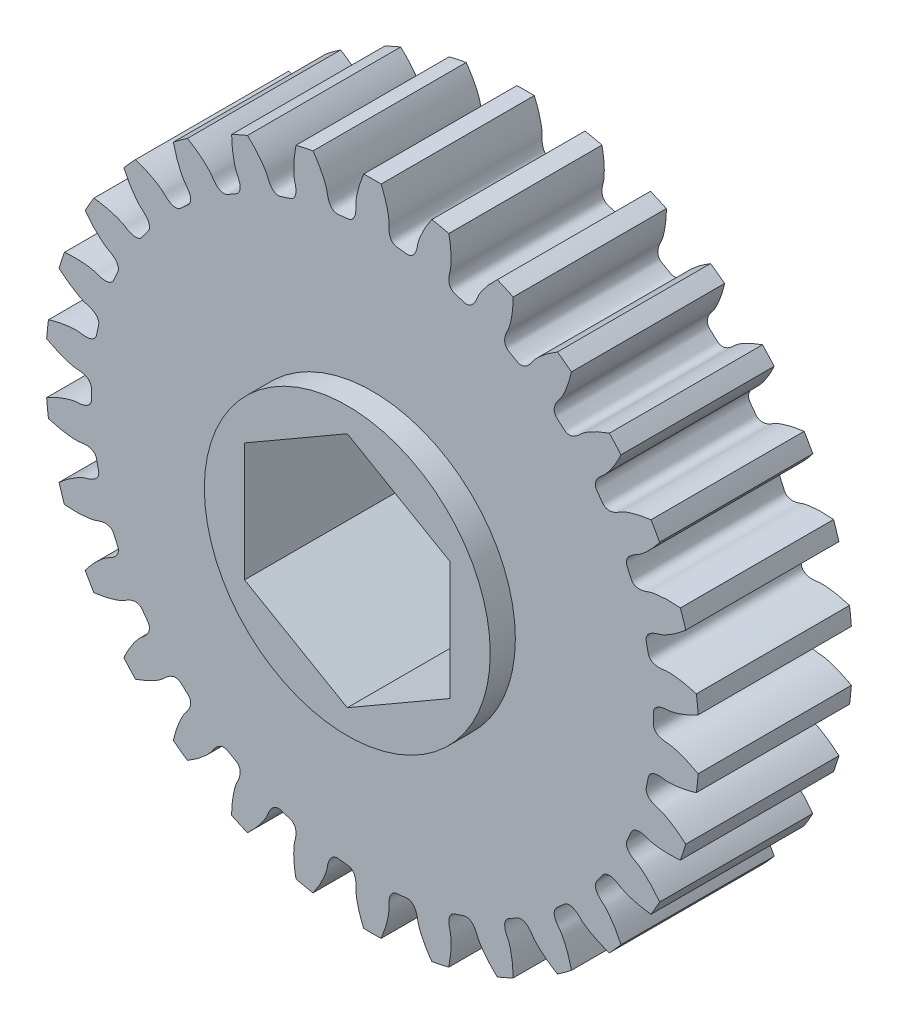
from build123d import *

# Parameters (mm, degrees)
BOSS_EXTRUDE1_DEPTH = 9.525
SKETCH2_R           = 8.89
BOSS_EXTRUDE2_DEPTH = 1.5621
BOSS_EXTRUDE3_START = 1.5621
SKETCH3_R           = 8.89
BOSS_EXTRUDE3_DEPTH = 1.5621
CUT_EXTRUDE1_DEPTH  = 32.357504029


with BuildPart() as part:
    # Sketch1 → Boss-Extrude1 (new body)
    with BuildSketch(Plane.XY.offset(4.7625)):
        with BuildLine():
            ThreePointArc((20.258045074, 1.585562928), (20.208684914, 2.124018374), (20.145015253, 2.66096983))
            add(Edge.make_bspline(
                [(19.485701115, 5.762798978), (19.348608261, 5.642423437), (19.165810451, 5.491857424), (18.935123769, 5.320049479), (18.810450403, 5.231600372), (18.691940584, 5.151573141), (18.579912745, 5.079632844), (18.474673043, 5.015434027), (18.37651506, 4.958621612), (18.285719533, 4.908831132), (18.202554043, 4.865689319), (18.127272877, 4.828814019), (18.060116392, 4.797816178), (18.001311973, 4.772295453), (17.95107022, 4.75185514), (17.9095951, 4.736060729), (17.877055221, 4.724555691), (17.829122133, 4.70860374), (17.776230485, 4.696697952), (17.717932348, 4.679918107), (17.675549853, 4.667098605), (17.634483818, 4.653717487), (17.594687889, 4.639851505), (17.55614131, 4.625474067), (17.51881179, 4.610577692), (17.482664521, 4.595140619), (17.447659244, 4.579133184), (17.413750427, 4.562513306), (17.380886724, 4.545223977), (17.349010841, 4.527189201), (17.318059756, 4.508308987), (17.287965678, 4.488452893), (17.258658302, 4.467451832), (17.230069256, 4.445087833), (17.202140202, 4.421081644), (17.174836845, 4.395078559), (17.148172171, 4.366634057), (17.122243426, 4.335203293), (17.097287767, 4.300142931), (17.073759769, 4.260741195), (17.052423821, 4.216300055), (17.034439896, 4.166300955), (17.021361823, 4.110656766), (17.015044254, 4.05005121), (17.016933283, 3.989508099), (17.041067734, 3.849516394), (17.098421884, 3.634381766), (17.133529397, 3.414518469), (17.168421235, 3.276813317), (17.191320623, 3.220736095), (17.22174251, 3.167939752), (17.256322455, 3.122425588), (17.293088054, 3.084063858), (17.330655253, 3.052142968), (17.368175278, 3.02571739), (17.405233741, 3.003838537), (17.441704872, 2.985671276), (17.477633685, 2.97053143), (17.51315295, 2.957881705), (17.548431607, 2.94731073), (17.583645258, 2.938508413), (17.61896078, 2.931243373), (17.654529288, 2.925344293), (17.690483786, 2.9206853), (17.726939259, 2.917174801), (17.763993949, 2.914747086), (17.801731108, 2.91335603), (17.84022083, 2.91297044), (17.879521827, 2.913570391), (17.919682942, 2.915145158), (17.960744825, 2.917689022), (18.002740018, 2.921208279), (18.045698299, 2.925687081), (18.089630796, 2.931214396), (18.149713772, 2.939597234), (18.202875217, 2.950233727), (18.253152515, 2.955157037), (18.287558694, 2.957881823), (18.331872267, 2.960322363), (18.386084217, 2.962084369), (18.450184941, 2.962687939), (18.5241434, 2.961685005), (18.607914703, 2.958617351), (18.701437515, 2.953031796), (18.804634969, 2.944475797), (18.91741444, 2.932499522), (19.039667703, 2.916655828), (19.171270981, 2.896500923), (19.312085096, 2.871594696), (19.461955375, 2.841501642), (19.742578732, 2.778376001), (19.970813556, 2.715177671), (20.145015253, 2.66096983)],
                knots=[0, 0, 0, 0, 0.077684917, 0.100781489, 0.122478269, 0.142775256, 0.161672451, 0.179169854, 0.195267465, 0.209965283, 0.223263309, 0.235161544, 0.245659985, 0.254758635, 0.262457493, 0.268756558, 0.273655832, 0.277155314, 0.290262703, 0.296705766, 0.302989147, 0.309117771, 0.315097288, 0.3209342, 0.326636023, 0.332211487, 0.337670777, 0.34302583, 0.348290706, 0.353482037, 0.358619588, 0.363726936, 0.368832295, 0.373969492, 0.379179082, 0.384509528, 0.390018285, 0.395772416, 0.401848037, 0.40832741, 0.415291917, 0.422808885, 0.430911277, 0.439572885, 0.448688114, 0.456601991, 0.5, 0.543398009, 0.551311886, 0.560427115, 0.569088723, 0.577191115, 0.584708083, 0.59167259, 0.598151963, 0.604227584, 0.609981715, 0.615490472, 0.620820918, 0.626030508, 0.631167705, 0.636273064, 0.641380412, 0.646517963, 0.651709294, 0.65697417, 0.662329223, 0.667788513, 0.673363977, 0.6790658, 0.684902712, 0.690882229, 0.697010853, 0.703294234, 0.709737297, 0.722844686, 0.726344168, 0.731243442, 0.737542507, 0.745241365, 0.754340015, 0.764838456, 0.776736691, 0.790034717, 0.804732535, 0.820830146, 0.838327549, 0.857224744, 0.877521731, 0.899218511, 0.922315083, 1, 1, 1, 1], degree=3))
            ThreePointArc((19.485701115, 5.762798978), (19.325468411, 6.279225326), (19.1515516, 6.791205438))
            add(Edge.make_bspline(
                [(17.861738515, 9.688173059), (17.752668951, 9.541924806), (17.605170146, 9.356643219), (17.415245402, 9.140627233), (17.311686052, 9.0281899), (17.212404553, 8.925271879), (17.11778202, 8.831611753), (17.028189743, 8.74693527), (16.943988712, 8.67095615), (16.865529308, 8.60337626), (16.793150871, 8.543886122), (16.727181585, 8.492164801), (16.667937444, 8.447881719), (16.6157241, 8.410692556), (16.57083003, 8.380253065), (16.533545083, 8.356180638), (16.504108311, 8.338161592), (16.460539273, 8.312592379), (16.411278786, 8.289949969), (16.35774333, 8.261415941), (16.318952318, 8.240064759), (16.281565765, 8.218437941), (16.245522373, 8.196600926), (16.210807366, 8.174523385), (16.177390717, 8.152191288), (16.1452429, 8.129576112), (16.114330705, 8.106640472), (16.084618344, 8.083333738), (16.056067445, 8.059589475), (16.028637768, 8.035321433), (16.002288455, 8.010418705), (15.976980319, 7.984739604), (15.952679746, 7.95810412), (15.929365176, 7.930284831), (15.907037606, 7.900996458), (15.885737239, 7.869884915), (15.865569197, 7.836518096), (15.84674188, 7.800383281), (15.82962102, 7.760900499), (15.814799248, 7.71746804), (15.803169374, 7.669562052), (15.795973838, 7.616916484), (15.79475063, 7.559769169), (15.801171718, 7.499174494), (15.815607088, 7.440347146), (15.868320056, 7.308432431), (15.969149884, 7.109923608), (16.049202364, 6.902164115), (16.111962243, 6.774722572), (16.146020334, 6.724631822), (16.186754407, 6.679314272), (16.230041623, 6.641984276), (16.273979658, 6.61210484), (16.31736265, 6.588692158), (16.359556959, 6.570644894), (16.400354475, 6.556949034), (16.43980581, 6.546761546), (16.478097243, 6.539422562), (16.515470352, 6.534434135), (16.552175916, 6.531429006), (16.588450169, 6.530140371), (16.624504448, 6.530376598), (16.660522187, 6.532001536), (16.696659652, 6.534919714), (16.733048359, 6.539065447), (16.769798066, 6.544394887), (16.806999794, 6.550880225), (16.844728592, 6.558505524), (16.883046031, 6.567263501), (16.922002117, 6.577153822), (16.961637801, 6.588179341), (17.001983602, 6.600352986), (17.043071947, 6.613665444), (17.08489522, 6.628206054), (17.141922348, 6.64889766), (17.191710637, 6.670354606), (17.239865642, 6.685623568), (17.272953449, 6.695442258), (17.315791247, 6.707042775), (17.368452194, 6.720037576), (17.431026675, 6.733955246), (17.503577486, 6.748351057), (17.586155986, 6.762767472), (17.678796402, 6.77674846), (17.781517636, 6.789835388), (17.894322612, 6.801568994), (18.017198438, 6.811489405), (18.150116308, 6.819136793), (18.293031593, 6.824051727), (18.445883545, 6.825776062), (18.733499167, 6.822374745), (18.969886184, 6.808010138), (19.1515516, 6.791205438)],
                knots=[0, 0, 0, 0, 0.077684917, 0.100781489, 0.122478269, 0.142775256, 0.161672451, 0.179169854, 0.195267465, 0.209965283, 0.223263309, 0.235161544, 0.245659985, 0.254758635, 0.262457493, 0.268756558, 0.273655832, 0.277155314, 0.290262703, 0.296705766, 0.302989147, 0.309117771, 0.315097288, 0.3209342, 0.326636023, 0.332211487, 0.337670777, 0.34302583, 0.348290706, 0.353482037, 0.358619588, 0.363726936, 0.368832295, 0.373969492, 0.379179082, 0.384509528, 0.390018285, 0.395772416, 0.401848037, 0.40832741, 0.415291917, 0.422808885, 0.430911277, 0.439572885, 0.448688114, 0.456601991, 0.5, 0.543398009, 0.551311886, 0.560427115, 0.569088723, 0.577191115, 0.584708083, 0.59167259, 0.598151963, 0.604227584, 0.609981715, 0.615490472, 0.620820918, 0.626030508, 0.631167705, 0.636273064, 0.641380412, 0.646517963, 0.651709294, 0.65697417, 0.662329223, 0.667788513, 0.673363977, 0.6790658, 0.684902712, 0.690882229, 0.697010853, 0.703294234, 0.709737297, 0.722844686, 0.726344168, 0.731243442, 0.737542507, 0.745241365, 0.754340015, 0.764838456, 0.776736691, 0.790034717, 0.804732535, 0.820830146, 0.838327549, 0.857224744, 0.877521731, 0.899218511, 0.922315083, 1, 1, 1, 1], degree=3))
            ThreePointArc((17.861738515, 9.688173059), (17.597636205, 10.16), (17.321073243, 10.62463278))
            add(Edge.make_bspline(
                [(15.457132232, 13.190127489), (15.380852821, 13.024398274), (15.275099427, 12.812498808), (15.134237243, 12.561715714), (15.056317949, 12.430204208), (14.980603849, 12.308893408), (14.907522081, 12.19760685), (14.83749284, 12.096153469), (14.770928751, 12.004328297), (14.708234523, 11.921912562), (14.649806423, 11.848674103), (14.596032192, 11.784367231), (14.547289648, 11.728734291), (14.503949352, 11.681502036), (14.466365051, 11.642393719), (14.434899809, 11.611095356), (14.409852671, 11.58734982), (14.37255186, 11.553280844), (14.329075455, 11.520891394), (14.282642434, 11.481850255), (14.24913826, 11.452900543), (14.217065161, 11.423973221), (14.186349575, 11.395119554), (14.156983353, 11.366306805), (14.128940041, 11.337515006), (14.102196691, 11.308710118), (14.076728589, 11.279848671), (14.052511257, 11.250873698), (14.029520974, 11.221712238), (14.00773631, 11.19227156), (13.987140361, 11.162434686), (13.967724255, 11.132054878), (13.949492536, 11.10094907), (13.9324714, 11.068890328), (13.916721136, 11.035599813), (13.902354687, 11.000739537), (13.889564716, 10.963908692), (13.878661672, 10.924649089), (13.870123877, 10.882469474), (13.864656111, 10.836904498), (13.863240593, 10.787627385), (13.867147926, 10.734636212), (13.877833043, 10.678483385), (13.896712156, 10.620547868), (13.923062972, 10.566007321), (14.002050646, 10.4479349), (14.141949406, 10.274727672), (14.263448175, 10.088152068), (14.351333186, 9.976543942), (14.395061479, 9.93462887), (14.444327463, 9.898770707), (14.494430092, 9.871256379), (14.54362026, 9.851165112), (14.590922999, 9.837283884), (14.635947499, 9.828403686), (14.67870102, 9.823489395), (14.719408347, 9.821726921), (14.758388881, 9.822509549), (14.795982451, 9.825400437), (14.832510711, 9.830092493), (14.868260207, 9.836373859), (14.903477499, 9.84410103), (14.938370321, 9.853178968), (14.973111372, 9.863546778), (15.007842952, 9.875167555), (15.042681537, 9.888021227), (15.07772194, 9.90209952), (15.113040884, 9.917402446), (15.14870011, 9.933935684), (15.184748598, 9.951709303), (15.221225813, 9.97073461), (15.258158919, 9.991030595), (15.295581569, 10.012594891), (15.333467741, 10.035513302), (15.384946663, 10.067609353), (15.429185808, 10.09894898), (15.473113915, 10.123896268), (15.503437253, 10.140379737), (15.542927059, 10.160633235), (15.591735467, 10.184292894), (15.650048899, 10.210916396), (15.718021243, 10.240081786), (15.795797864, 10.271352203), (15.883507054, 10.304288699), (15.981262657, 10.338446591), (16.08916302, 10.373377263), (16.207291145, 10.40862821), (16.33571446, 10.443743663), (16.47448483, 10.478264953), (16.623638091, 10.511731315), (16.905675795, 10.568202975), (17.139883759, 10.603299893), (17.321073243, 10.62463278)],
                knots=[0, 0, 0, 0, 0.077684917, 0.100781489, 0.122478269, 0.142775256, 0.161672451, 0.179169854, 0.195267465, 0.209965283, 0.223263309, 0.235161544, 0.245659985, 0.254758635, 0.262457493, 0.268756558, 0.273655832, 0.277155314, 0.290262703, 0.296705766, 0.302989147, 0.309117771, 0.315097288, 0.3209342, 0.326636023, 0.332211487, 0.337670777, 0.34302583, 0.348290706, 0.353482037, 0.358619588, 0.363726936, 0.368832295, 0.373969492, 0.379179082, 0.384509528, 0.390018285, 0.395772416, 0.401848037, 0.40832741, 0.415291917, 0.422808885, 0.430911277, 0.439572885, 0.448688114, 0.456601991, 0.5, 0.543398009, 0.551311886, 0.560427115, 0.569088723, 0.577191115, 0.584708083, 0.59167259, 0.598151963, 0.604227584, 0.609981715, 0.615490472, 0.620820918, 0.626030508, 0.631167705, 0.636273064, 0.641380412, 0.646517963, 0.651709294, 0.65697417, 0.662329223, 0.667788513, 0.673363977, 0.6790658, 0.684902712, 0.690882229, 0.697010853, 0.703294234, 0.709737297, 0.722844686, 0.726344168, 0.731243442, 0.737542507, 0.745241365, 0.754340015, 0.764838456, 0.776736691, 0.790034717, 0.804732535, 0.820830146, 0.838327549, 0.857224744, 0.877521731, 0.899218511, 0.922315083, 1, 1, 1, 1], degree=3))
            ThreePointArc((15.457132232, 13.190127489), (15.100702854, 13.596733921), (14.733580869, 13.993712687))
            add(Edge.make_bspline(
                [(12.376975098, 16.115610054), (12.336819617, 15.937643039), (12.277433564, 15.708386718), (12.191790295, 15.433796941), (12.142916504, 15.288958945), (12.094078872, 15.154557231), (12.045731892, 15.030507997), (11.998326302, 14.916711718), (11.952308325, 14.813053694), (11.908119311, 14.719404077), (11.866195137, 14.635618169), (11.826966152, 14.561536265), (11.790855489, 14.496984894), (11.75828242, 14.441773823), (11.729650503, 14.395705901), (11.705380147, 14.358549491), (11.685817324, 14.330115259), (11.656414963, 14.289035496), (11.620622767, 14.248314581), (11.583321529, 14.200472616), (11.556568485, 14.165189615), (11.531210588, 14.130226053), (11.507165226, 14.095616779), (11.484431234, 14.061328077), (11.462986888, 14.027334915), (11.442816816, 13.993599228), (11.423905887, 13.960073356), (11.406241997, 13.92669649), (11.389817115, 13.893392329), (11.374629559, 13.860065714), (11.360687116, 13.826598709), (11.348011615, 13.792845937), (11.336645564, 13.758629278), (11.326661769, 13.723732203), (11.318177173, 13.687894502), (11.311372524, 13.650809054), (11.306519608, 13.612123866), (11.304017353, 13.57145531), (11.304435763, 13.528422313), (11.308560973, 13.482716229), (11.317421675, 13.434221636), (11.332261108, 13.383200828), (11.354387558, 13.330496635), (11.384899589, 13.277752337), (11.422014194, 13.229882274), (11.523824434, 13.13081248), (11.696677878, 12.990476833), (11.854312857, 12.833239368), (11.963482004, 12.742342468), (12.014969362, 12.710434965), (12.070614097, 12.685603363), (12.125342415, 12.669107212), (12.177634868, 12.659682197), (12.226789999, 12.655939101), (12.272676902, 12.656614076), (12.315517895, 12.660696131), (12.355702108, 12.667435701), (12.393668106, 12.676305734), (12.429839117, 12.686949592), (12.464593613, 12.699133768), (12.498255928, 12.712710609), (12.531097068, 12.72759101), (12.563339989, 12.743725199), (12.595166276, 12.761089518), (12.626722792, 12.779677454), (12.658127641, 12.799493592), (12.689475287, 12.82054955), (12.72084077, 12.842861291), (12.752283303, 12.866447208), (12.783848702, 12.891327333), (12.815573218, 12.917520932), (12.847479474, 12.945052225), (12.87960088, 12.973925896), (12.911894143, 13.004220462), (12.955574982, 13.046318207), (12.992331522, 13.086170824), (13.030112861, 13.119706121), (13.056346455, 13.142133963), (13.090762376, 13.170155266), (13.133585083, 13.203445744), (13.185088889, 13.241611502), (13.245512049, 13.284271803), (13.315087579, 13.331029555), (13.39403223, 13.381482076), (13.482549814, 13.435218069), (13.5808298, 13.491819168), (13.689047457, 13.550860016), (13.807363501, 13.611908821), (13.935924026, 13.67452772), (14.074859883, 13.738273468), (14.338993268, 13.852150023), (14.560786166, 13.935174563), (14.733580869, 13.993712687)],
                knots=[0, 0, 0, 0, 0.077684917, 0.100781489, 0.122478269, 0.142775256, 0.161672451, 0.179169854, 0.195267465, 0.209965283, 0.223263309, 0.235161544, 0.245659985, 0.254758635, 0.262457493, 0.268756558, 0.273655832, 0.277155314, 0.290262703, 0.296705766, 0.302989147, 0.309117771, 0.315097288, 0.3209342, 0.326636023, 0.332211487, 0.337670777, 0.34302583, 0.348290706, 0.353482037, 0.358619588, 0.363726936, 0.368832295, 0.373969492, 0.379179082, 0.384509528, 0.390018285, 0.395772416, 0.401848037, 0.40832741, 0.415291917, 0.422808885, 0.430911277, 0.439572885, 0.448688114, 0.456601991, 0.5, 0.543398009, 0.551311886, 0.560427115, 0.569088723, 0.577191115, 0.584708083, 0.59167259, 0.598151963, 0.604227584, 0.609981715, 0.615490472, 0.620820918, 0.626030508, 0.631167705, 0.636273064, 0.641380412, 0.646517963, 0.651709294, 0.65697417, 0.662329223, 0.667788513, 0.673363977, 0.6790658, 0.684902712, 0.690882229, 0.697010853, 0.703294234, 0.709737297, 0.722844686, 0.726344168, 0.731243442, 0.737542507, 0.745241365, 0.754340015, 0.764838456, 0.776736691, 0.790034717, 0.804732535, 0.820830146, 0.838327549, 0.857224744, 0.877521731, 0.899218511, 0.922315083, 1, 1, 1, 1], degree=3))
            ThreePointArc((12.376975098, 16.115610054), (11.943796327, 16.439225326), (11.502160312, 16.751200201))
            add(Edge.make_bspline(
                [(8.755884762, 18.336763129), (8.753608197, 18.154336325), (8.743184942, 17.91774275), (8.716503607, 17.631347183), (8.698811339, 17.479512811), (8.678984614, 17.337894182), (8.657485418, 17.20650382), (8.634775331, 17.085338086), (8.611314672, 16.974377563), (8.587562144, 16.873587003), (8.563974184, 16.782915492), (8.54100494, 16.702296291), (8.519104366, 16.631647693), (8.498722124, 16.570870795), (8.480293943, 16.519856657), (8.464279204, 16.478466112), (8.451055685, 16.446585897), (8.430836799, 16.400290731), (8.404293103, 16.353018049), (8.37775389, 16.298466183), (8.358921212, 16.25839193), (8.34138678, 16.218920203), (8.32506254, 16.180067912), (8.309954362, 16.141801837), (8.296046202, 16.104092977), (8.283330938, 16.066900902), (8.271803679, 16.030175848), (8.261465228, 15.993855817), (8.252323593, 15.957864507), (8.244396915, 15.922108488), (8.23771733, 15.886474021), (8.232336415, 15.850823443), (8.228332783, 15.814991365), (8.225822667, 15.778781127), (8.224974557, 15.741962519), (8.226029104, 15.704272711), (8.229325339, 15.66542391), (8.235333232, 15.625123811), (8.244689562, 15.583118181), (8.258227455, 15.539268564), (8.276977122, 15.493675937), (8.302100101, 15.446855348), (8.334700853, 15.399903216), (8.375512279, 15.354655315), (8.421768586, 15.315547888), (8.541951797, 15.239810546), (8.7402054, 15.138479822), (8.927087183, 15.017452527), (9.052769251, 14.951239485), (9.10976543, 14.930734061), (9.169356974, 14.91801428), (9.226319089, 14.913257266), (9.279428398, 14.914910423), (9.328287605, 14.921469048), (9.373031433, 14.931669697), (9.414087542, 14.944569693), (9.451992397, 14.959516754), (9.487284564, 14.976086532), (9.520452169, 14.994018171), (9.551913963, 15.01316196), (9.582017892, 15.033440903), (9.611047565, 15.054824189), (9.639231414, 15.077309487), (9.666751975, 15.100911412), (9.693754256, 15.125654125), (9.720352828, 15.151566668), (9.746637672, 15.178680045), (9.772678872, 15.207025472), (9.798530522, 15.23663325), (9.824233273, 15.2675325), (9.849818577, 15.299749603), (9.875303527, 15.333312956), (9.90071983, 15.368234083), (9.926008812, 15.404580787), (9.959982508, 15.454840353), (9.987650003, 15.501464209), (10.01763335, 15.542121861), (10.038630666, 15.569513872), (10.06646856, 15.604078314), (10.101434009, 15.645544657), (10.143877226, 15.693584645), (10.19411042, 15.747875398), (10.252444074, 15.808076946), (10.319173926, 15.873840474), (10.394584847, 15.944806048), (10.478949149, 16.020603836), (10.572526709, 16.100854215), (10.675564503, 16.185168246), (10.788296471, 16.273148008), (10.91094276, 16.364387148), (11.14562793, 16.530691645), (11.345312348, 16.658015236), (11.502160312, 16.751200201)],
                knots=[0, 0, 0, 0, 0.077684917, 0.100781489, 0.122478269, 0.142775256, 0.161672451, 0.179169854, 0.195267465, 0.209965283, 0.223263309, 0.235161544, 0.245659985, 0.254758635, 0.262457493, 0.268756558, 0.273655832, 0.277155314, 0.290262703, 0.296705766, 0.302989147, 0.309117771, 0.315097288, 0.3209342, 0.326636023, 0.332211487, 0.337670777, 0.34302583, 0.348290706, 0.353482037, 0.358619588, 0.363726936, 0.368832295, 0.373969492, 0.379179082, 0.384509528, 0.390018285, 0.395772416, 0.401848037, 0.40832741, 0.415291917, 0.422808885, 0.430911277, 0.439572885, 0.448688114, 0.456601991, 0.5, 0.543398009, 0.551311886, 0.560427115, 0.569088723, 0.577191115, 0.584708083, 0.59167259, 0.598151963, 0.604227584, 0.609981715, 0.615490472, 0.620820918, 0.626030508, 0.631167705, 0.636273064, 0.641380412, 0.646517963, 0.651709294, 0.65697417, 0.662329223, 0.667788513, 0.673363977, 0.6790658, 0.684902712, 0.690882229, 0.697010853, 0.703294234, 0.709737297, 0.722844686, 0.726344168, 0.731243442, 0.737542507, 0.745241365, 0.754340015, 0.764838456, 0.776736691, 0.790034717, 0.804732535, 0.820830146, 0.838327549, 0.857224744, 0.877521731, 0.899218511, 0.922315083, 1, 1, 1, 1], degree=3))
            ThreePointArc((8.755884762, 18.336763129), (8.264888587, 18.563243699), (7.768040155, 18.776579884))
            add(Edge.make_bspline(
                [(4.752120246, 19.756511665), (4.787822095, 19.577598001), (4.826817183, 19.344007446), (4.860263886, 19.058322948), (4.874526377, 18.906128092), (4.884577082, 18.763481962), (4.890865288, 18.63049286), (4.893843243, 18.507253195), (4.893965246, 18.393839681), (4.891687303, 18.290313208), (4.887466464, 18.196718874), (4.881760828, 18.113085822), (4.875027503, 18.03942768), (4.86772689, 17.975741197), (4.860307844, 17.922010405), (4.853248644, 17.878194693), (4.84694236, 17.844261812), (4.836790611, 17.794774564), (4.820655502, 17.743016159), (4.806038205, 17.68413857), (4.795948972, 17.641024501), (4.787004343, 17.598769712), (4.779114672, 17.557372436), (4.772292608, 17.5168014), (4.766528488, 17.4770249), (4.761823751, 17.43800191), (4.758183957, 17.399682734), (4.755622786, 17.362006898), (4.754163932, 17.324901431), (4.753844565, 17.288278719), (4.754719767, 17.252034186), (4.75686861, 17.216043904), (4.760402374, 17.180162441), (4.765475642, 17.144221601), (4.772301085, 17.108031236), (4.781168739, 17.071384293), (4.792470064, 17.034069757), (4.806725531, 16.995899423), (4.824610865, 16.956757007), (4.846969771, 16.916680296), (4.874788953, 16.875982253), (4.909097481, 16.835408166), (4.950747726, 16.796260129), (5.000074892, 16.760486176), (5.053451279, 16.731850567), (5.186754878, 16.682755762), (5.401744006, 16.624858599), (5.609704963, 16.545330949), (5.746407042, 16.506695591), (5.806421034, 16.498488432), (5.867354952, 16.498436388), (5.924061347, 16.505626416), (5.975666379, 16.518285494), (6.02209428, 16.534859197), (6.063739515, 16.554139703), (6.101216389, 16.575293847), (6.135185263, 16.597795142), (6.166261161, 16.621340484), (6.194975777, 16.645776208), (6.221769838, 16.671042933), (6.246999694, 16.697137691), (6.270949164, 16.72408931), (6.293842172, 16.751943002), (6.315854227, 16.780751014), (6.337122144, 16.81056713), (6.357751952, 16.841443576), (6.377825222, 16.873429386), (6.397404014, 16.906569668), (6.41653494, 16.940905305), (6.435251708, 16.976473235), (6.453579599, 17.013305801), (6.471529429, 17.051434333), (6.489129814, 17.090876696), (6.506309267, 17.131687013), (6.529091004, 17.187911815), (6.546460254, 17.239269223), (6.567335191, 17.285272296), (6.582178547, 17.316431314), (6.602221764, 17.356028263), (6.627801796, 17.403858193), (6.659329452, 17.459672833), (6.697177248, 17.523221271), (6.741719566, 17.59423552), (6.793318204, 17.672435873), (6.852326644, 17.757529491), (6.919088137, 17.84921124), (6.993935811, 17.947163824), (7.077192109, 18.051058154), (7.169168592, 18.160553641), (7.270165081, 18.275298583), (7.465145168, 18.486762719), (7.633993939, 18.65282071), (7.768040155, 18.776579884)],
                knots=[0, 0, 0, 0, 0.077684917, 0.100781489, 0.122478269, 0.142775256, 0.161672451, 0.179169854, 0.195267465, 0.209965283, 0.223263309, 0.235161544, 0.245659985, 0.254758635, 0.262457493, 0.268756558, 0.273655832, 0.277155314, 0.290262703, 0.296705766, 0.302989147, 0.309117771, 0.315097288, 0.3209342, 0.326636023, 0.332211487, 0.337670777, 0.34302583, 0.348290706, 0.353482037, 0.358619588, 0.363726936, 0.368832295, 0.373969492, 0.379179082, 0.384509528, 0.390018285, 0.395772416, 0.401848037, 0.40832741, 0.415291917, 0.422808885, 0.430911277, 0.439572885, 0.448688114, 0.456601991, 0.5, 0.543398009, 0.551311886, 0.560427115, 0.569088723, 0.577191115, 0.584708083, 0.59167259, 0.598151963, 0.604227584, 0.609981715, 0.615490472, 0.620820918, 0.626030508, 0.631167705, 0.636273064, 0.641380412, 0.646517963, 0.651709294, 0.65697417, 0.662329223, 0.667788513, 0.673363977, 0.6790658, 0.684902712, 0.690882229, 0.697010853, 0.703294234, 0.709737297, 0.722844686, 0.726344168, 0.731243442, 0.737542507, 0.745241365, 0.754340015, 0.764838456, 0.776736691, 0.790034717, 0.804732535, 0.820830146, 0.838327549, 0.857224744, 0.877521731, 0.899218511, 0.922315083, 1, 1, 1, 1], degree=3))
            ThreePointArc((4.752120246, 19.756511665), (4.224765557, 19.875959247), (3.694419369, 19.981332927))
            add(Edge.make_bspline(
                [(0.540665272, 20.312805839), (0.612785192, 20.1452247), (0.699494351, 19.924846194), (0.791607311, 19.652358548), (0.837201222, 19.506454853), (0.876690093, 19.369015543), (0.910490876, 19.240239963), (0.939026722, 19.120312533), (0.962726055, 19.009402741), (0.982022254, 18.907664959), (0.997353007, 18.815238325), (1.009160342, 18.732246587), (1.017888546, 18.658798115), (1.023988633, 18.594985451), (1.02790297, 18.5408863), (1.03010783, 18.496560376), (1.030994396, 18.46205786), (1.031353464, 18.41154136), (1.026332124, 18.357559322), (1.024275589, 18.296929242), (1.023370749, 18.25265965), (1.023406846, 18.209468537), (1.02429656, 18.167335536), (1.026058768, 18.126232688), (1.028690607, 18.086126972), (1.032202015, 18.046978557), (1.036608765, 18.008739991), (1.041936808, 17.971354965), (1.048224494, 17.93475703), (1.055526396, 17.898868211), (1.063918134, 17.863597673), (1.07350282, 17.828840634), (1.084419539, 17.794477978), (1.096854465, 17.760377324), (1.111055155, 17.726396895), (1.127348358, 17.692394464), (1.14616085, 17.658245018), (1.16804086, 17.623872676), (1.193673522, 17.589304185), (1.223876249, 17.554751924), (1.259549114, 17.520727164), (1.301543746, 17.488172863), (1.350423168, 17.458539877), (1.40611024, 17.433803365), (1.464273902, 17.416891088), (1.604871881, 17.396584499), (1.827200478, 17.384651281), (2.047151718, 17.350099015), (2.18889927, 17.340729893), (2.249308178, 17.34517969), (2.308921364, 17.357797657), (2.362893697, 17.376620488), (2.410739065, 17.399732224), (2.452706538, 17.425596656), (2.489433082, 17.453114368), (2.521692802, 17.481598123), (2.550241094, 17.510670238), (2.575742556, 17.5401621), (2.598749216, 17.570033948), (2.619704516, 17.600319334), (2.638957633, 17.631089441), (2.656780194, 17.662431477), (2.673381826, 17.694436223), (2.688923342, 17.727191274), (2.703527385, 17.760777685), (2.717286809, 17.795268585), (2.730271205, 17.830728896), (2.742531901, 17.867215643), (2.75410599, 17.904778507), (2.765018764, 17.943460627), (2.775288226, 17.983298896), (2.784918441, 18.024326207), (2.793933687, 18.066565986), (2.802252786, 18.110056309), (2.812846894, 18.169789053), (2.819158778, 18.223635449), (2.830012971, 18.272973388), (2.83805364, 18.306537614), (2.849426196, 18.349436494), (2.864502842, 18.401539612), (2.883737026, 18.462689537), (2.907545294, 18.532718288), (2.936349563, 18.611441574), (2.970561879, 18.698661022), (3.010588885, 18.794163685), (3.056829772, 18.897722463), (3.109676357, 19.009096254), (3.16951246, 19.128030201), (3.236713644, 19.254255935), (3.311646302, 19.387491777), (3.45839974, 19.634873553), (3.589033363, 19.832408412), (3.694419369, 19.981332927)],
                knots=[0, 0, 0, 0, 0.077684917, 0.100781489, 0.122478269, 0.142775256, 0.161672451, 0.179169854, 0.195267465, 0.209965283, 0.223263309, 0.235161544, 0.245659985, 0.254758635, 0.262457493, 0.268756558, 0.273655832, 0.277155314, 0.290262703, 0.296705766, 0.302989147, 0.309117771, 0.315097288, 0.3209342, 0.326636023, 0.332211487, 0.337670777, 0.34302583, 0.348290706, 0.353482037, 0.358619588, 0.363726936, 0.368832295, 0.373969492, 0.379179082, 0.384509528, 0.390018285, 0.395772416, 0.401848037, 0.40832741, 0.415291917, 0.422808885, 0.430911277, 0.439572885, 0.448688114, 0.456601991, 0.5, 0.543398009, 0.551311886, 0.560427115, 0.569088723, 0.577191115, 0.584708083, 0.59167259, 0.598151963, 0.604227584, 0.609981715, 0.615490472, 0.620820918, 0.626030508, 0.631167705, 0.636273064, 0.641380412, 0.646517963, 0.651709294, 0.65697417, 0.662329223, 0.667788513, 0.673363977, 0.6790658, 0.684902712, 0.690882229, 0.697010853, 0.703294234, 0.709737297, 0.722844686, 0.726344168, 0.731243442, 0.737542507, 0.745241365, 0.754340015, 0.764838456, 0.776736691, 0.790034717, 0.804732535, 0.820830146, 0.838327549, 0.857224744, 0.877521731, 0.899218511, 0.922315083, 1, 1, 1, 1], degree=3))
            ThreePointArc((0.540665272, 20.312805839), (0, 20.32), (-0.540665272, 20.312805839))
            add(Edge.make_bspline(
                [(-3.694419369, 19.981332927), (-3.589033363, 19.832408412), (-3.45839974, 19.634873553), (-3.311646302, 19.387491777), (-3.236713644, 19.254255935), (-3.16951246, 19.128030201), (-3.109676357, 19.009096254), (-3.056829772, 18.897722463), (-3.010588885, 18.794163685), (-2.970561879, 18.698661022), (-2.936349563, 18.611441574), (-2.907545294, 18.532718288), (-2.883737026, 18.462689537), (-2.864502842, 18.401539612), (-2.849426196, 18.349436494), (-2.83805364, 18.306537614), (-2.830012971, 18.272973388), (-2.819158778, 18.223635449), (-2.812846894, 18.169789053), (-2.802252786, 18.110056309), (-2.793933687, 18.066565986), (-2.784918441, 18.024326207), (-2.775288226, 17.983298896), (-2.765018764, 17.943460627), (-2.75410599, 17.904778507), (-2.742531901, 17.867215643), (-2.730271205, 17.830728896), (-2.717286809, 17.795268585), (-2.703527385, 17.760777685), (-2.688923342, 17.727191274), (-2.673381826, 17.694436223), (-2.656780194, 17.662431477), (-2.638957633, 17.631089441), (-2.619704516, 17.600319334), (-2.598749216, 17.570033948), (-2.575742556, 17.5401621), (-2.550241094, 17.510670238), (-2.521692802, 17.481598123), (-2.489433082, 17.453114368), (-2.452706538, 17.425596656), (-2.410739065, 17.399732224), (-2.362893697, 17.376620488), (-2.308921364, 17.357797657), (-2.249308178, 17.34517969), (-2.18889927, 17.340729893), (-2.047151718, 17.350099015), (-1.827200478, 17.384651281), (-1.604871881, 17.396584499), (-1.464273902, 17.416891088), (-1.40611024, 17.433803365), (-1.350423168, 17.458539877), (-1.301543746, 17.488172863), (-1.259549114, 17.520727164), (-1.223876249, 17.554751924), (-1.193673522, 17.589304185), (-1.16804086, 17.623872676), (-1.14616085, 17.658245018), (-1.127348358, 17.692394464), (-1.111055155, 17.726396895), (-1.096854465, 17.760377324), (-1.084419539, 17.794477978), (-1.07350282, 17.828840634), (-1.063918134, 17.863597673), (-1.055526396, 17.898868211), (-1.048224494, 17.93475703), (-1.041936808, 17.971354965), (-1.036608765, 18.008739991), (-1.032202015, 18.046978557), (-1.028690607, 18.086126972), (-1.026058768, 18.126232688), (-1.02429656, 18.167335536), (-1.023406846, 18.209468537), (-1.023370749, 18.25265965), (-1.024275589, 18.296929242), (-1.026332124, 18.357559322), (-1.031353464, 18.41154136), (-1.030994396, 18.46205786), (-1.03010783, 18.496560376), (-1.02790297, 18.5408863), (-1.023988633, 18.594985451), (-1.017888546, 18.658798115), (-1.009160342, 18.732246587), (-0.997353007, 18.815238325), (-0.982022254, 18.907664959), (-0.962726055, 19.009402741), (-0.939026722, 19.120312533), (-0.910490876, 19.240239963), (-0.876690093, 19.369015543), (-0.837201222, 19.506454853), (-0.791607311, 19.652358548), (-0.699494351, 19.924846194), (-0.612785192, 20.1452247), (-0.540665272, 20.312805839)],
                knots=[0, 0, 0, 0, 0.077684917, 0.100781489, 0.122478269, 0.142775256, 0.161672451, 0.179169854, 0.195267465, 0.209965283, 0.223263309, 0.235161544, 0.245659985, 0.254758635, 0.262457493, 0.268756558, 0.273655832, 0.277155314, 0.290262703, 0.296705766, 0.302989147, 0.309117771, 0.315097288, 0.3209342, 0.326636023, 0.332211487, 0.337670777, 0.34302583, 0.348290706, 0.353482037, 0.358619588, 0.363726936, 0.368832295, 0.373969492, 0.379179082, 0.384509528, 0.390018285, 0.395772416, 0.401848037, 0.40832741, 0.415291917, 0.422808885, 0.430911277, 0.439572885, 0.448688114, 0.456601991, 0.5, 0.543398009, 0.551311886, 0.560427115, 0.569088723, 0.577191115, 0.584708083, 0.59167259, 0.598151963, 0.604227584, 0.609981715, 0.615490472, 0.620820918, 0.626030508, 0.631167705, 0.636273064, 0.641380412, 0.646517963, 0.651709294, 0.65697417, 0.662329223, 0.667788513, 0.673363977, 0.6790658, 0.684902712, 0.690882229, 0.697010853, 0.703294234, 0.709737297, 0.722844686, 0.726344168, 0.731243442, 0.737542507, 0.745241365, 0.754340015, 0.764838456, 0.776736691, 0.790034717, 0.804732535, 0.820830146, 0.838327549, 0.857224744, 0.877521731, 0.899218511, 0.922315083, 1, 1, 1, 1], degree=3))
            ThreePointArc((-3.694419369, 19.981332927), (-4.224765557, 19.875959247), (-4.752120246, 19.756511665))
            add(Edge.make_bspline(
                [(-7.768040155, 18.776579884), (-7.633993939, 18.65282071), (-7.465145168, 18.486762719), (-7.270165081, 18.275298583), (-7.169168592, 18.160553641), (-7.077192109, 18.051058154), (-6.993935811, 17.947163824), (-6.919088137, 17.84921124), (-6.852326644, 17.757529491), (-6.793318204, 17.672435873), (-6.741719566, 17.59423552), (-6.697177248, 17.523221271), (-6.659329452, 17.459672833), (-6.627801796, 17.403858193), (-6.602221764, 17.356028263), (-6.582178547, 17.316431314), (-6.567335191, 17.285272296), (-6.546460254, 17.239269223), (-6.529091004, 17.187911815), (-6.506309267, 17.131687013), (-6.489129814, 17.090876696), (-6.471529429, 17.051434333), (-6.453579599, 17.013305801), (-6.435251708, 16.976473235), (-6.41653494, 16.940905305), (-6.397404014, 16.906569668), (-6.377825222, 16.873429386), (-6.357751952, 16.841443576), (-6.337122144, 16.81056713), (-6.315854227, 16.780751014), (-6.293842172, 16.751943002), (-6.270949164, 16.72408931), (-6.246999694, 16.697137691), (-6.221769838, 16.671042933), (-6.194975777, 16.645776208), (-6.166261161, 16.621340484), (-6.135185263, 16.597795142), (-6.101216389, 16.575293847), (-6.063739515, 16.554139703), (-6.02209428, 16.534859197), (-5.975666379, 16.518285494), (-5.924061347, 16.505626416), (-5.867354952, 16.498436388), (-5.806421034, 16.498488432), (-5.746407042, 16.506695591), (-5.609704963, 16.545330949), (-5.401744006, 16.624858599), (-5.186754878, 16.682755762), (-5.053451279, 16.731850567), (-5.000074892, 16.760486176), (-4.950747726, 16.796260129), (-4.909097481, 16.835408166), (-4.874788953, 16.875982253), (-4.846969771, 16.916680296), (-4.824610865, 16.956757007), (-4.806725531, 16.995899423), (-4.792470064, 17.034069757), (-4.781168739, 17.071384293), (-4.772301085, 17.108031236), (-4.765475642, 17.144221601), (-4.760402374, 17.180162441), (-4.75686861, 17.216043904), (-4.754719767, 17.252034186), (-4.753844565, 17.288278719), (-4.754163932, 17.324901431), (-4.755622786, 17.362006898), (-4.758183957, 17.399682734), (-4.761823751, 17.43800191), (-4.766528488, 17.4770249), (-4.772292608, 17.5168014), (-4.779114672, 17.557372436), (-4.787004343, 17.598769712), (-4.795948972, 17.641024501), (-4.806038205, 17.68413857), (-4.820655502, 17.743016159), (-4.836790611, 17.794774564), (-4.84694236, 17.844261812), (-4.853248644, 17.878194693), (-4.860307844, 17.922010405), (-4.86772689, 17.975741197), (-4.875027503, 18.03942768), (-4.881760828, 18.113085822), (-4.887466464, 18.196718874), (-4.891687303, 18.290313208), (-4.893965246, 18.393839681), (-4.893843243, 18.507253195), (-4.890865288, 18.63049286), (-4.884577082, 18.763481962), (-4.874526377, 18.906128092), (-4.860263886, 19.058322948), (-4.826817183, 19.344007446), (-4.787822095, 19.577598001), (-4.752120246, 19.756511665)],
                knots=[0, 0, 0, 0, 0.077684917, 0.100781489, 0.122478269, 0.142775256, 0.161672451, 0.179169854, 0.195267465, 0.209965283, 0.223263309, 0.235161544, 0.245659985, 0.254758635, 0.262457493, 0.268756558, 0.273655832, 0.277155314, 0.290262703, 0.296705766, 0.302989147, 0.309117771, 0.315097288, 0.3209342, 0.326636023, 0.332211487, 0.337670777, 0.34302583, 0.348290706, 0.353482037, 0.358619588, 0.363726936, 0.368832295, 0.373969492, 0.379179082, 0.384509528, 0.390018285, 0.395772416, 0.401848037, 0.40832741, 0.415291917, 0.422808885, 0.430911277, 0.439572885, 0.448688114, 0.456601991, 0.5, 0.543398009, 0.551311886, 0.560427115, 0.569088723, 0.577191115, 0.584708083, 0.59167259, 0.598151963, 0.604227584, 0.609981715, 0.615490472, 0.620820918, 0.626030508, 0.631167705, 0.636273064, 0.641380412, 0.646517963, 0.651709294, 0.65697417, 0.662329223, 0.667788513, 0.673363977, 0.6790658, 0.684902712, 0.690882229, 0.697010853, 0.703294234, 0.709737297, 0.722844686, 0.726344168, 0.731243442, 0.737542507, 0.745241365, 0.754340015, 0.764838456, 0.776736691, 0.790034717, 0.804732535, 0.820830146, 0.838327549, 0.857224744, 0.877521731, 0.899218511, 0.922315083, 1, 1, 1, 1], degree=3))
            ThreePointArc((-7.768040155, 18.776579884), (-8.264888587, 18.563243699), (-8.755884762, 18.336763129))
            add(Edge.make_bspline(
                [(-11.502160312, 16.751200201), (-11.345312348, 16.658015236), (-11.14562793, 16.530691645), (-10.91094276, 16.364387148), (-10.788296471, 16.273148008), (-10.675564503, 16.185168246), (-10.572526709, 16.100854215), (-10.478949149, 16.020603836), (-10.394584847, 15.944806048), (-10.319173926, 15.873840474), (-10.252444074, 15.808076946), (-10.19411042, 15.747875398), (-10.143877226, 15.693584645), (-10.101434009, 15.645544657), (-10.06646856, 15.604078314), (-10.038630666, 15.569513872), (-10.01763335, 15.542121861), (-9.987650003, 15.501464209), (-9.959982508, 15.454840353), (-9.926008812, 15.404580787), (-9.90071983, 15.368234083), (-9.875303527, 15.333312956), (-9.849818577, 15.299749603), (-9.824233273, 15.2675325), (-9.798530522, 15.23663325), (-9.772678872, 15.207025472), (-9.746637672, 15.178680045), (-9.720352828, 15.151566668), (-9.693754256, 15.125654125), (-9.666751975, 15.100911412), (-9.639231414, 15.077309487), (-9.611047565, 15.054824189), (-9.582017892, 15.033440903), (-9.551913963, 15.01316196), (-9.520452169, 14.994018171), (-9.487284564, 14.976086532), (-9.451992397, 14.959516754), (-9.414087542, 14.944569693), (-9.373031433, 14.931669697), (-9.328287605, 14.921469048), (-9.279428398, 14.914910423), (-9.226319089, 14.913257266), (-9.169356974, 14.91801428), (-9.10976543, 14.930734061), (-9.052769251, 14.951239485), (-8.927087183, 15.017452527), (-8.7402054, 15.138479822), (-8.541951797, 15.239810546), (-8.421768586, 15.315547888), (-8.375512279, 15.354655315), (-8.334700853, 15.399903216), (-8.302100101, 15.446855348), (-8.276977122, 15.493675937), (-8.258227455, 15.539268564), (-8.244689562, 15.583118181), (-8.235333232, 15.625123811), (-8.229325339, 15.66542391), (-8.226029104, 15.704272711), (-8.224974557, 15.741962519), (-8.225822667, 15.778781127), (-8.228332783, 15.814991365), (-8.232336415, 15.850823443), (-8.23771733, 15.886474021), (-8.244396915, 15.922108488), (-8.252323593, 15.957864507), (-8.261465228, 15.993855817), (-8.271803679, 16.030175848), (-8.283330938, 16.066900902), (-8.296046202, 16.104092977), (-8.309954362, 16.141801837), (-8.32506254, 16.180067912), (-8.34138678, 16.218920203), (-8.358921212, 16.25839193), (-8.37775389, 16.298466183), (-8.404293103, 16.353018049), (-8.430836799, 16.400290731), (-8.451055685, 16.446585897), (-8.464279204, 16.478466112), (-8.480293943, 16.519856657), (-8.498722124, 16.570870795), (-8.519104366, 16.631647693), (-8.54100494, 16.702296291), (-8.563974184, 16.782915492), (-8.587562144, 16.873587003), (-8.611314672, 16.974377563), (-8.634775331, 17.085338086), (-8.657485418, 17.20650382), (-8.678984614, 17.337894182), (-8.698811339, 17.479512811), (-8.716503607, 17.631347183), (-8.743184942, 17.91774275), (-8.753608197, 18.154336325), (-8.755884762, 18.336763129)],
                knots=[0, 0, 0, 0, 0.077684917, 0.100781489, 0.122478269, 0.142775256, 0.161672451, 0.179169854, 0.195267465, 0.209965283, 0.223263309, 0.235161544, 0.245659985, 0.254758635, 0.262457493, 0.268756558, 0.273655832, 0.277155314, 0.290262703, 0.296705766, 0.302989147, 0.309117771, 0.315097288, 0.3209342, 0.326636023, 0.332211487, 0.337670777, 0.34302583, 0.348290706, 0.353482037, 0.358619588, 0.363726936, 0.368832295, 0.373969492, 0.379179082, 0.384509528, 0.390018285, 0.395772416, 0.401848037, 0.40832741, 0.415291917, 0.422808885, 0.430911277, 0.439572885, 0.448688114, 0.456601991, 0.5, 0.543398009, 0.551311886, 0.560427115, 0.569088723, 0.577191115, 0.584708083, 0.59167259, 0.598151963, 0.604227584, 0.609981715, 0.615490472, 0.620820918, 0.626030508, 0.631167705, 0.636273064, 0.641380412, 0.646517963, 0.651709294, 0.65697417, 0.662329223, 0.667788513, 0.673363977, 0.6790658, 0.684902712, 0.690882229, 0.697010853, 0.703294234, 0.709737297, 0.722844686, 0.726344168, 0.731243442, 0.737542507, 0.745241365, 0.754340015, 0.764838456, 0.776736691, 0.790034717, 0.804732535, 0.820830146, 0.838327549, 0.857224744, 0.877521731, 0.899218511, 0.922315083, 1, 1, 1, 1], degree=3))
            ThreePointArc((-11.502160312, 16.751200201), (-11.943796327, 16.439225326), (-12.376975098, 16.115610054))
            add(Edge.make_bspline(
                [(-14.733580869, 13.993712687), (-14.560786166, 13.935174563), (-14.338993268, 13.852150023), (-14.074859883, 13.738273468), (-13.935924026, 13.67452772), (-13.807363501, 13.611908821), (-13.689047457, 13.550860016), (-13.5808298, 13.491819168), (-13.482549814, 13.435218069), (-13.39403223, 13.381482076), (-13.315087579, 13.331029555), (-13.245512049, 13.284271803), (-13.185088889, 13.241611502), (-13.133585083, 13.203445744), (-13.090762376, 13.170155266), (-13.056346455, 13.142133963), (-13.030112861, 13.119706121), (-12.992331522, 13.086170824), (-12.955574982, 13.046318207), (-12.911894143, 13.004220462), (-12.87960088, 12.973925896), (-12.847479474, 12.945052225), (-12.815573218, 12.917520932), (-12.783848702, 12.891327333), (-12.752283303, 12.866447208), (-12.72084077, 12.842861291), (-12.689475287, 12.82054955), (-12.658127641, 12.799493592), (-12.626722792, 12.779677454), (-12.595166276, 12.761089518), (-12.563339989, 12.743725199), (-12.531097068, 12.72759101), (-12.498255928, 12.712710609), (-12.464593613, 12.699133768), (-12.429839117, 12.686949592), (-12.393668106, 12.676305734), (-12.355702108, 12.667435701), (-12.315517895, 12.660696131), (-12.272676902, 12.656614076), (-12.226789999, 12.655939101), (-12.177634868, 12.659682197), (-12.125342415, 12.669107212), (-12.070614097, 12.685603363), (-12.014969362, 12.710434965), (-11.963482004, 12.742342468), (-11.854312857, 12.833239368), (-11.696677878, 12.990476833), (-11.523824434, 13.13081248), (-11.422014194, 13.229882274), (-11.384899589, 13.277752337), (-11.354387558, 13.330496635), (-11.332261108, 13.383200828), (-11.317421675, 13.434221636), (-11.308560973, 13.482716229), (-11.304435763, 13.528422313), (-11.304017353, 13.57145531), (-11.306519608, 13.612123866), (-11.311372524, 13.650809054), (-11.318177173, 13.687894502), (-11.326661769, 13.723732203), (-11.336645564, 13.758629278), (-11.348011615, 13.792845937), (-11.360687116, 13.826598709), (-11.374629559, 13.860065714), (-11.389817115, 13.893392329), (-11.406241997, 13.92669649), (-11.423905887, 13.960073356), (-11.442816816, 13.993599228), (-11.462986888, 14.027334915), (-11.484431234, 14.061328077), (-11.507165226, 14.095616779), (-11.531210588, 14.130226053), (-11.556568485, 14.165189615), (-11.583321529, 14.200472616), (-11.620622767, 14.248314581), (-11.656414963, 14.289035496), (-11.685817324, 14.330115259), (-11.705380147, 14.358549491), (-11.729650503, 14.395705901), (-11.75828242, 14.441773823), (-11.790855489, 14.496984894), (-11.826966152, 14.561536265), (-11.866195137, 14.635618169), (-11.908119311, 14.719404077), (-11.952308325, 14.813053694), (-11.998326302, 14.916711718), (-12.045731892, 15.030507997), (-12.094078872, 15.154557231), (-12.142916504, 15.288958945), (-12.191790295, 15.433796941), (-12.277433564, 15.708386718), (-12.336819617, 15.937643039), (-12.376975098, 16.115610054)],
                knots=[0, 0, 0, 0, 0.077684917, 0.100781489, 0.122478269, 0.142775256, 0.161672451, 0.179169854, 0.195267465, 0.209965283, 0.223263309, 0.235161544, 0.245659985, 0.254758635, 0.262457493, 0.268756558, 0.273655832, 0.277155314, 0.290262703, 0.296705766, 0.302989147, 0.309117771, 0.315097288, 0.3209342, 0.326636023, 0.332211487, 0.337670777, 0.34302583, 0.348290706, 0.353482037, 0.358619588, 0.363726936, 0.368832295, 0.373969492, 0.379179082, 0.384509528, 0.390018285, 0.395772416, 0.401848037, 0.40832741, 0.415291917, 0.422808885, 0.430911277, 0.439572885, 0.448688114, 0.456601991, 0.5, 0.543398009, 0.551311886, 0.560427115, 0.569088723, 0.577191115, 0.584708083, 0.59167259, 0.598151963, 0.604227584, 0.609981715, 0.615490472, 0.620820918, 0.626030508, 0.631167705, 0.636273064, 0.641380412, 0.646517963, 0.651709294, 0.65697417, 0.662329223, 0.667788513, 0.673363977, 0.6790658, 0.684902712, 0.690882229, 0.697010853, 0.703294234, 0.709737297, 0.722844686, 0.726344168, 0.731243442, 0.737542507, 0.745241365, 0.754340015, 0.764838456, 0.776736691, 0.790034717, 0.804732535, 0.820830146, 0.838327549, 0.857224744, 0.877521731, 0.899218511, 0.922315083, 1, 1, 1, 1], degree=3))
            ThreePointArc((-14.733580869, 13.993712687), (-15.100702854, 13.596733921), (-15.457132232, 13.190127489))
            add(Edge.make_bspline(
                [(-17.321073243, 10.62463278), (-17.139883759, 10.603299893), (-16.905675795, 10.568202975), (-16.623638091, 10.511731315), (-16.47448483, 10.478264953), (-16.33571446, 10.443743663), (-16.207291145, 10.40862821), (-16.08916302, 10.373377263), (-15.981262657, 10.338446591), (-15.883507054, 10.304288699), (-15.795797864, 10.271352203), (-15.718021243, 10.240081786), (-15.650048899, 10.210916396), (-15.591735467, 10.184292894), (-15.542927059, 10.160633235), (-15.503437253, 10.140379737), (-15.473113915, 10.123896268), (-15.429185808, 10.09894898), (-15.384946663, 10.067609353), (-15.333467741, 10.035513302), (-15.295581569, 10.012594891), (-15.258158919, 9.991030595), (-15.221225813, 9.97073461), (-15.184748598, 9.951709303), (-15.14870011, 9.933935684), (-15.113040884, 9.917402446), (-15.07772194, 9.90209952), (-15.042681537, 9.888021227), (-15.007842952, 9.875167555), (-14.973111372, 9.863546778), (-14.938370321, 9.853178968), (-14.903477499, 9.84410103), (-14.868260207, 9.836373859), (-14.832510711, 9.830092493), (-14.795982451, 9.825400437), (-14.758388881, 9.822509549), (-14.719408347, 9.821726921), (-14.67870102, 9.823489395), (-14.635947499, 9.828403686), (-14.590922999, 9.837283884), (-14.54362026, 9.851165112), (-14.494430092, 9.871256379), (-14.444327463, 9.898770707), (-14.395061479, 9.93462887), (-14.351333186, 9.976543942), (-14.263448175, 10.088152068), (-14.141949406, 10.274727672), (-14.002050646, 10.4479349), (-13.923062972, 10.566007321), (-13.896712156, 10.620547868), (-13.877833043, 10.678483385), (-13.867147926, 10.734636212), (-13.863240593, 10.787627385), (-13.864656111, 10.836904498), (-13.870123877, 10.882469474), (-13.878661672, 10.924649089), (-13.889564716, 10.963908692), (-13.902354687, 11.000739537), (-13.916721136, 11.035599813), (-13.9324714, 11.068890328), (-13.949492536, 11.10094907), (-13.967724255, 11.132054878), (-13.987140361, 11.162434686), (-14.00773631, 11.19227156), (-14.029520974, 11.221712238), (-14.052511257, 11.250873698), (-14.076728589, 11.279848671), (-14.102196691, 11.308710118), (-14.128940041, 11.337515006), (-14.156983353, 11.366306805), (-14.186349575, 11.395119554), (-14.217065161, 11.423973221), (-14.24913826, 11.452900543), (-14.282642434, 11.481850255), (-14.329075455, 11.520891394), (-14.37255186, 11.553280844), (-14.409852671, 11.58734982), (-14.434899809, 11.611095356), (-14.466365051, 11.642393719), (-14.503949352, 11.681502036), (-14.547289648, 11.728734291), (-14.596032192, 11.784367231), (-14.649806423, 11.848674103), (-14.708234523, 11.921912562), (-14.770928751, 12.004328297), (-14.83749284, 12.096153469), (-14.907522081, 12.19760685), (-14.980603849, 12.308893408), (-15.056317949, 12.430204208), (-15.134237243, 12.561715714), (-15.275099427, 12.812498808), (-15.380852821, 13.024398274), (-15.457132232, 13.190127489)],
                knots=[0, 0, 0, 0, 0.077684917, 0.100781489, 0.122478269, 0.142775256, 0.161672451, 0.179169854, 0.195267465, 0.209965283, 0.223263309, 0.235161544, 0.245659985, 0.254758635, 0.262457493, 0.268756558, 0.273655832, 0.277155314, 0.290262703, 0.296705766, 0.302989147, 0.309117771, 0.315097288, 0.3209342, 0.326636023, 0.332211487, 0.337670777, 0.34302583, 0.348290706, 0.353482037, 0.358619588, 0.363726936, 0.368832295, 0.373969492, 0.379179082, 0.384509528, 0.390018285, 0.395772416, 0.401848037, 0.40832741, 0.415291917, 0.422808885, 0.430911277, 0.439572885, 0.448688114, 0.456601991, 0.5, 0.543398009, 0.551311886, 0.560427115, 0.569088723, 0.577191115, 0.584708083, 0.59167259, 0.598151963, 0.604227584, 0.609981715, 0.615490472, 0.620820918, 0.626030508, 0.631167705, 0.636273064, 0.641380412, 0.646517963, 0.651709294, 0.65697417, 0.662329223, 0.667788513, 0.673363977, 0.6790658, 0.684902712, 0.690882229, 0.697010853, 0.703294234, 0.709737297, 0.722844686, 0.726344168, 0.731243442, 0.737542507, 0.745241365, 0.754340015, 0.764838456, 0.776736691, 0.790034717, 0.804732535, 0.820830146, 0.838327549, 0.857224744, 0.877521731, 0.899218511, 0.922315083, 1, 1, 1, 1], degree=3))
            ThreePointArc((-17.321073243, 10.62463278), (-17.597636205, 10.16), (-17.861738515, 9.688173059))
            add(Edge.make_bspline(
                [(-19.1515516, 6.791205438), (-18.969886184, 6.808010138), (-18.733499167, 6.822374745), (-18.445883545, 6.825776062), (-18.293031593, 6.824051727), (-18.150116308, 6.819136793), (-18.017198438, 6.811489405), (-17.894322612, 6.801568994), (-17.781517636, 6.789835388), (-17.678796402, 6.77674846), (-17.586155986, 6.762767472), (-17.503577486, 6.748351057), (-17.431026675, 6.733955246), (-17.368452194, 6.720037576), (-17.315791247, 6.707042775), (-17.272953449, 6.695442258), (-17.239865642, 6.685623568), (-17.191710637, 6.670354606), (-17.141922348, 6.64889766), (-17.08489522, 6.628206054), (-17.043071947, 6.613665444), (-17.001983602, 6.600352986), (-16.961637801, 6.588179341), (-16.922002117, 6.577153822), (-16.883046031, 6.567263501), (-16.844728592, 6.558505524), (-16.806999794, 6.550880225), (-16.769798066, 6.544394887), (-16.733048359, 6.539065447), (-16.696659652, 6.534919714), (-16.660522187, 6.532001536), (-16.624504448, 6.530376598), (-16.588450169, 6.530140371), (-16.552175916, 6.531429006), (-16.515470352, 6.534434135), (-16.478097243, 6.539422562), (-16.43980581, 6.546761546), (-16.400354475, 6.556949034), (-16.359556959, 6.570644894), (-16.31736265, 6.588692158), (-16.273979658, 6.61210484), (-16.230041623, 6.641984276), (-16.186754407, 6.679314272), (-16.146020334, 6.724631822), (-16.111962243, 6.774722572), (-16.049202364, 6.902164115), (-15.969149884, 7.109923608), (-15.868320056, 7.308432431), (-15.815607088, 7.440347146), (-15.801171718, 7.499174494), (-15.79475063, 7.559769169), (-15.795973838, 7.616916484), (-15.803169374, 7.669562052), (-15.814799248, 7.71746804), (-15.82962102, 7.760900499), (-15.84674188, 7.800383281), (-15.865569197, 7.836518096), (-15.885737239, 7.869884915), (-15.907037606, 7.900996458), (-15.929365176, 7.930284831), (-15.952679746, 7.95810412), (-15.976980319, 7.984739604), (-16.002288455, 8.010418705), (-16.028637768, 8.035321433), (-16.056067445, 8.059589475), (-16.084618344, 8.083333738), (-16.114330705, 8.106640472), (-16.1452429, 8.129576112), (-16.177390717, 8.152191288), (-16.210807366, 8.174523385), (-16.245522373, 8.196600926), (-16.281565765, 8.218437941), (-16.318952318, 8.240064759), (-16.35774333, 8.261415941), (-16.411278786, 8.289949969), (-16.460539273, 8.312592379), (-16.504108311, 8.338161592), (-16.533545083, 8.356180638), (-16.57083003, 8.380253065), (-16.6157241, 8.410692556), (-16.667937444, 8.447881719), (-16.727181585, 8.492164801), (-16.793150871, 8.543886122), (-16.865529308, 8.60337626), (-16.943988712, 8.67095615), (-17.028189743, 8.74693527), (-17.11778202, 8.831611753), (-17.212404553, 8.925271879), (-17.311686052, 9.0281899), (-17.415245402, 9.140627233), (-17.605170146, 9.356643219), (-17.752668951, 9.541924806), (-17.861738515, 9.688173059)],
                knots=[0, 0, 0, 0, 0.077684917, 0.100781489, 0.122478269, 0.142775256, 0.161672451, 0.179169854, 0.195267465, 0.209965283, 0.223263309, 0.235161544, 0.245659985, 0.254758635, 0.262457493, 0.268756558, 0.273655832, 0.277155314, 0.290262703, 0.296705766, 0.302989147, 0.309117771, 0.315097288, 0.3209342, 0.326636023, 0.332211487, 0.337670777, 0.34302583, 0.348290706, 0.353482037, 0.358619588, 0.363726936, 0.368832295, 0.373969492, 0.379179082, 0.384509528, 0.390018285, 0.395772416, 0.401848037, 0.40832741, 0.415291917, 0.422808885, 0.430911277, 0.439572885, 0.448688114, 0.456601991, 0.5, 0.543398009, 0.551311886, 0.560427115, 0.569088723, 0.577191115, 0.584708083, 0.59167259, 0.598151963, 0.604227584, 0.609981715, 0.615490472, 0.620820918, 0.626030508, 0.631167705, 0.636273064, 0.641380412, 0.646517963, 0.651709294, 0.65697417, 0.662329223, 0.667788513, 0.673363977, 0.6790658, 0.684902712, 0.690882229, 0.697010853, 0.703294234, 0.709737297, 0.722844686, 0.726344168, 0.731243442, 0.737542507, 0.745241365, 0.754340015, 0.764838456, 0.776736691, 0.790034717, 0.804732535, 0.820830146, 0.838327549, 0.857224744, 0.877521731, 0.899218511, 0.922315083, 1, 1, 1, 1], degree=3))
            ThreePointArc((-19.1515516, 6.791205438), (-19.325468411, 6.279225326), (-19.485701115, 5.762798978))
            add(Edge.make_bspline(
                [(-20.145015253, 2.66096983), (-19.970813556, 2.715177671), (-19.742578732, 2.778376001), (-19.461955375, 2.841501642), (-19.312085096, 2.871594696), (-19.171270981, 2.896500923), (-19.039667703, 2.916655828), (-18.91741444, 2.932499522), (-18.804634969, 2.944475797), (-18.701437515, 2.953031796), (-18.607914703, 2.958617351), (-18.5241434, 2.961685005), (-18.450184941, 2.962687939), (-18.386084217, 2.962084369), (-18.331872267, 2.960322363), (-18.287558694, 2.957881823), (-18.253152515, 2.955157037), (-18.202875217, 2.950233727), (-18.149713772, 2.939597234), (-18.089630796, 2.931214396), (-18.045698299, 2.925687081), (-18.002740018, 2.921208279), (-17.960744825, 2.917689022), (-17.919682942, 2.915145158), (-17.879521827, 2.913570391), (-17.84022083, 2.91297044), (-17.801731108, 2.91335603), (-17.763993949, 2.914747086), (-17.726939259, 2.917174801), (-17.690483786, 2.9206853), (-17.654529288, 2.925344293), (-17.61896078, 2.931243373), (-17.583645258, 2.938508413), (-17.548431607, 2.94731073), (-17.51315295, 2.957881705), (-17.477633685, 2.97053143), (-17.441704872, 2.985671276), (-17.405233741, 3.003838537), (-17.368175278, 3.02571739), (-17.330655253, 3.052142968), (-17.293088054, 3.084063858), (-17.256322455, 3.122425588), (-17.22174251, 3.167939752), (-17.191320623, 3.220736095), (-17.168421235, 3.276813317), (-17.133529397, 3.414518469), (-17.098421884, 3.634381766), (-17.041067734, 3.849516394), (-17.016933283, 3.989508099), (-17.015044254, 4.05005121), (-17.021361823, 4.110656766), (-17.034439896, 4.166300955), (-17.052423821, 4.216300055), (-17.073759769, 4.260741195), (-17.097287767, 4.300142931), (-17.122243426, 4.335203293), (-17.148172171, 4.366634057), (-17.174836845, 4.395078559), (-17.202140202, 4.421081644), (-17.230069256, 4.445087833), (-17.258658302, 4.467451832), (-17.287965678, 4.488452893), (-17.318059756, 4.508308987), (-17.349010841, 4.527189201), (-17.380886724, 4.545223977), (-17.413750427, 4.562513306), (-17.447659244, 4.579133184), (-17.482664521, 4.595140619), (-17.51881179, 4.610577692), (-17.55614131, 4.625474067), (-17.594687889, 4.639851505), (-17.634483818, 4.653717487), (-17.675549853, 4.667098605), (-17.717932348, 4.679918107), (-17.776230485, 4.696697952), (-17.829122133, 4.70860374), (-17.877055221, 4.724555691), (-17.9095951, 4.736060729), (-17.95107022, 4.75185514), (-18.001311973, 4.772295453), (-18.060116392, 4.797816178), (-18.127272877, 4.828814019), (-18.202554043, 4.865689319), (-18.285719533, 4.908831132), (-18.37651506, 4.958621612), (-18.474673043, 5.015434027), (-18.579912745, 5.079632844), (-18.691940584, 5.151573141), (-18.810450403, 5.231600372), (-18.935123769, 5.320049479), (-19.165810451, 5.491857424), (-19.348608261, 5.642423437), (-19.485701115, 5.762798978)],
                knots=[0, 0, 0, 0, 0.077684917, 0.100781489, 0.122478269, 0.142775256, 0.161672451, 0.179169854, 0.195267465, 0.209965283, 0.223263309, 0.235161544, 0.245659985, 0.254758635, 0.262457493, 0.268756558, 0.273655832, 0.277155314, 0.290262703, 0.296705766, 0.302989147, 0.309117771, 0.315097288, 0.3209342, 0.326636023, 0.332211487, 0.337670777, 0.34302583, 0.348290706, 0.353482037, 0.358619588, 0.363726936, 0.368832295, 0.373969492, 0.379179082, 0.384509528, 0.390018285, 0.395772416, 0.401848037, 0.40832741, 0.415291917, 0.422808885, 0.430911277, 0.439572885, 0.448688114, 0.456601991, 0.5, 0.543398009, 0.551311886, 0.560427115, 0.569088723, 0.577191115, 0.584708083, 0.59167259, 0.598151963, 0.604227584, 0.609981715, 0.615490472, 0.620820918, 0.626030508, 0.631167705, 0.636273064, 0.641380412, 0.646517963, 0.651709294, 0.65697417, 0.662329223, 0.667788513, 0.673363977, 0.6790658, 0.684902712, 0.690882229, 0.697010853, 0.703294234, 0.709737297, 0.722844686, 0.726344168, 0.731243442, 0.737542507, 0.745241365, 0.754340015, 0.764838456, 0.776736691, 0.790034717, 0.804732535, 0.820830146, 0.838327549, 0.857224744, 0.877521731, 0.899218511, 0.922315083, 1, 1, 1, 1], degree=3))
            ThreePointArc((-20.145015253, 2.66096983), (-20.208684914, 2.124018374), (-20.258045074, 1.585562928))
            add(Edge.make_bspline(
                [(-20.258045074, -1.585562928), (-20.098920545, -1.496321089), (-19.888812871, -1.387051106), (-19.627446367, -1.266960035), (-19.48710781, -1.206364804), (-19.354549117, -1.152725936), (-19.230012127, -1.105649605), (-19.11372448, -1.06473425), (-19.005899519, -1.029571515), (-18.906736069, -0.999746528), (-18.816418257, -0.974838545), (-18.73511536, -0.954420894), (-18.662981592, -0.938063048), (-18.600156133, -0.925326138), (-18.546762503, -0.915778343), (-18.502909871, -0.90895224), (-18.468689035, -0.904464036), (-18.418486802, -0.898826523), (-18.364275611, -0.898177696), (-18.303762703, -0.893885396), (-18.259641042, -0.890157847), (-18.216690307, -0.885607247), (-18.174881116, -0.880318309), (-18.134187635, -0.874269337), (-18.094576724, -0.867459727), (-18.056009811, -0.859875431), (-18.018441351, -0.851495803), (-17.981818056, -0.842289148), (-17.946077849, -0.832210381), (-17.91114889, -0.821197077), (-17.876948743, -0.809164534), (-17.84338398, -0.795999254), (-17.810350674, -0.781550462), (-17.77773663, -0.765619167), (-17.745426726, -0.747944348), (-17.713313668, -0.728186179), (-17.681317736, -0.705907155), (-17.649420773, -0.680554118), (-17.617720996, -0.651448483), (-17.58651506, -0.617799515), (-17.556405521, -0.578765514), (-17.52841919, -0.533598082), (-17.504057827, -0.481888936), (-17.485277709, -0.423921254), (-17.474537837, -0.364308404), (-17.46903898, -0.222358019), (-17.4804108, 0), (-17.46903898, 0.222358019), (-17.474537837, 0.364308404), (-17.485277709, 0.423921254), (-17.504057827, 0.481888936), (-17.52841919, 0.533598082), (-17.556405521, 0.578765514), (-17.58651506, 0.617799515), (-17.617720996, 0.651448483), (-17.649420773, 0.680554118), (-17.681317736, 0.705907155), (-17.713313668, 0.728186179), (-17.745426726, 0.747944348), (-17.77773663, 0.765619167), (-17.810350674, 0.781550462), (-17.84338398, 0.795999254), (-17.876948743, 0.809164534), (-17.91114889, 0.821197077), (-17.946077849, 0.832210381), (-17.981818056, 0.842289148), (-18.018441351, 0.851495803), (-18.056009811, 0.859875431), (-18.094576724, 0.867459727), (-18.134187635, 0.874269337), (-18.174881116, 0.880318309), (-18.216690307, 0.885607247), (-18.259641042, 0.890157847), (-18.303762703, 0.893885396), (-18.364275611, 0.898177696), (-18.418486802, 0.898826523), (-18.468689035, 0.904464036), (-18.502909871, 0.90895224), (-18.546762503, 0.915778343), (-18.600156133, 0.925326138), (-18.662981592, 0.938063048), (-18.73511536, 0.954420894), (-18.816418257, 0.974838545), (-18.906736069, 0.999746528), (-19.005899519, 1.029571515), (-19.11372448, 1.06473425), (-19.230012127, 1.105649605), (-19.354549117, 1.152725936), (-19.48710781, 1.206364804), (-19.627446367, 1.266960035), (-19.888812871, 1.387051106), (-20.098920545, 1.496321089), (-20.258045074, 1.585562928)],
                knots=[0, 0, 0, 0, 0.077684917, 0.100781489, 0.122478269, 0.142775256, 0.161672451, 0.179169854, 0.195267465, 0.209965283, 0.223263309, 0.235161544, 0.245659985, 0.254758635, 0.262457493, 0.268756558, 0.273655832, 0.277155314, 0.290262703, 0.296705766, 0.302989147, 0.309117771, 0.315097288, 0.3209342, 0.326636023, 0.332211487, 0.337670777, 0.34302583, 0.348290706, 0.353482037, 0.358619588, 0.363726936, 0.368832295, 0.373969492, 0.379179082, 0.384509528, 0.390018285, 0.395772416, 0.401848037, 0.40832741, 0.415291917, 0.422808885, 0.430911277, 0.439572885, 0.448688114, 0.456601991, 0.5, 0.543398009, 0.551311886, 0.560427115, 0.569088723, 0.577191115, 0.584708083, 0.59167259, 0.598151963, 0.604227584, 0.609981715, 0.615490472, 0.620820918, 0.626030508, 0.631167705, 0.636273064, 0.641380412, 0.646517963, 0.651709294, 0.65697417, 0.662329223, 0.667788513, 0.673363977, 0.6790658, 0.684902712, 0.690882229, 0.697010853, 0.703294234, 0.709737297, 0.722844686, 0.726344168, 0.731243442, 0.737542507, 0.745241365, 0.754340015, 0.764838456, 0.776736691, 0.790034717, 0.804732535, 0.820830146, 0.838327549, 0.857224744, 0.877521731, 0.899218511, 0.922315083, 1, 1, 1, 1], degree=3))
            ThreePointArc((-20.258045074, -1.585562928), (-20.208684914, -2.124018374), (-20.145015253, -2.66096983))
            add(Edge.make_bspline(
                [(-19.485701115, -5.762798978), (-19.348608261, -5.642423437), (-19.165810451, -5.491857424), (-18.935123769, -5.320049479), (-18.810450403, -5.231600372), (-18.691940584, -5.151573141), (-18.579912745, -5.079632844), (-18.474673043, -5.015434027), (-18.37651506, -4.958621612), (-18.285719533, -4.908831132), (-18.202554043, -4.865689319), (-18.127272877, -4.828814019), (-18.060116392, -4.797816178), (-18.001311973, -4.772295453), (-17.95107022, -4.75185514), (-17.9095951, -4.736060729), (-17.877055221, -4.724555691), (-17.829122133, -4.70860374), (-17.776230485, -4.696697952), (-17.717932348, -4.679918107), (-17.675549853, -4.667098605), (-17.634483818, -4.653717487), (-17.594687889, -4.639851505), (-17.55614131, -4.625474067), (-17.51881179, -4.610577692), (-17.482664521, -4.595140619), (-17.447659244, -4.579133184), (-17.413750427, -4.562513306), (-17.380886724, -4.545223977), (-17.349010841, -4.527189201), (-17.318059756, -4.508308987), (-17.287965678, -4.488452893), (-17.258658302, -4.467451832), (-17.230069256, -4.445087833), (-17.202140202, -4.421081644), (-17.174836845, -4.395078559), (-17.148172171, -4.366634057), (-17.122243426, -4.335203293), (-17.097287767, -4.300142931), (-17.073759769, -4.260741195), (-17.052423821, -4.216300055), (-17.034439896, -4.166300955), (-17.021361823, -4.110656766), (-17.015044254, -4.05005121), (-17.016933283, -3.989508099), (-17.041067734, -3.849516394), (-17.098421884, -3.634381766), (-17.133529397, -3.414518469), (-17.168421235, -3.276813317), (-17.191320623, -3.220736095), (-17.22174251, -3.167939752), (-17.256322455, -3.122425588), (-17.293088054, -3.084063858), (-17.330655253, -3.052142968), (-17.368175278, -3.02571739), (-17.405233741, -3.003838537), (-17.441704872, -2.985671276), (-17.477633685, -2.97053143), (-17.51315295, -2.957881705), (-17.548431607, -2.94731073), (-17.583645258, -2.938508413), (-17.61896078, -2.931243373), (-17.654529288, -2.925344293), (-17.690483786, -2.9206853), (-17.726939259, -2.917174801), (-17.763993949, -2.914747086), (-17.801731108, -2.91335603), (-17.84022083, -2.91297044), (-17.879521827, -2.913570391), (-17.919682942, -2.915145158), (-17.960744825, -2.917689022), (-18.002740018, -2.921208279), (-18.045698299, -2.925687081), (-18.089630796, -2.931214396), (-18.149713772, -2.939597234), (-18.202875217, -2.950233727), (-18.253152515, -2.955157037), (-18.287558694, -2.957881823), (-18.331872267, -2.960322363), (-18.386084217, -2.962084369), (-18.450184941, -2.962687939), (-18.5241434, -2.961685005), (-18.607914703, -2.958617351), (-18.701437515, -2.953031796), (-18.804634969, -2.944475797), (-18.91741444, -2.932499522), (-19.039667703, -2.916655828), (-19.171270981, -2.896500923), (-19.312085096, -2.871594696), (-19.461955375, -2.841501642), (-19.742578732, -2.778376001), (-19.970813556, -2.715177671), (-20.145015253, -2.66096983)],
                knots=[0, 0, 0, 0, 0.077684917, 0.100781489, 0.122478269, 0.142775256, 0.161672451, 0.179169854, 0.195267465, 0.209965283, 0.223263309, 0.235161544, 0.245659985, 0.254758635, 0.262457493, 0.268756558, 0.273655832, 0.277155314, 0.290262703, 0.296705766, 0.302989147, 0.309117771, 0.315097288, 0.3209342, 0.326636023, 0.332211487, 0.337670777, 0.34302583, 0.348290706, 0.353482037, 0.358619588, 0.363726936, 0.368832295, 0.373969492, 0.379179082, 0.384509528, 0.390018285, 0.395772416, 0.401848037, 0.40832741, 0.415291917, 0.422808885, 0.430911277, 0.439572885, 0.448688114, 0.456601991, 0.5, 0.543398009, 0.551311886, 0.560427115, 0.569088723, 0.577191115, 0.584708083, 0.59167259, 0.598151963, 0.604227584, 0.609981715, 0.615490472, 0.620820918, 0.626030508, 0.631167705, 0.636273064, 0.641380412, 0.646517963, 0.651709294, 0.65697417, 0.662329223, 0.667788513, 0.673363977, 0.6790658, 0.684902712, 0.690882229, 0.697010853, 0.703294234, 0.709737297, 0.722844686, 0.726344168, 0.731243442, 0.737542507, 0.745241365, 0.754340015, 0.764838456, 0.776736691, 0.790034717, 0.804732535, 0.820830146, 0.838327549, 0.857224744, 0.877521731, 0.899218511, 0.922315083, 1, 1, 1, 1], degree=3))
            ThreePointArc((-19.485701115, -5.762798978), (-19.325468411, -6.279225326), (-19.1515516, -6.791205438))
            add(Edge.make_bspline(
                [(-17.861738515, -9.688173059), (-17.752668951, -9.541924806), (-17.605170146, -9.356643219), (-17.415245402, -9.140627233), (-17.311686052, -9.0281899), (-17.212404553, -8.925271879), (-17.11778202, -8.831611753), (-17.028189743, -8.74693527), (-16.943988712, -8.67095615), (-16.865529308, -8.60337626), (-16.793150871, -8.543886122), (-16.727181585, -8.492164801), (-16.667937444, -8.447881719), (-16.6157241, -8.410692556), (-16.57083003, -8.380253065), (-16.533545083, -8.356180638), (-16.504108311, -8.338161592), (-16.460539273, -8.312592379), (-16.411278786, -8.289949969), (-16.35774333, -8.261415941), (-16.318952318, -8.240064759), (-16.281565765, -8.218437941), (-16.245522373, -8.196600926), (-16.210807366, -8.174523385), (-16.177390717, -8.152191288), (-16.1452429, -8.129576112), (-16.114330705, -8.106640472), (-16.084618344, -8.083333738), (-16.056067445, -8.059589475), (-16.028637768, -8.035321433), (-16.002288455, -8.010418705), (-15.976980319, -7.984739604), (-15.952679746, -7.95810412), (-15.929365176, -7.930284831), (-15.907037606, -7.900996458), (-15.885737239, -7.869884915), (-15.865569197, -7.836518096), (-15.84674188, -7.800383281), (-15.82962102, -7.760900499), (-15.814799248, -7.71746804), (-15.803169374, -7.669562052), (-15.795973838, -7.616916484), (-15.79475063, -7.559769169), (-15.801171718, -7.499174494), (-15.815607088, -7.440347146), (-15.868320056, -7.308432431), (-15.969149884, -7.109923608), (-16.049202364, -6.902164115), (-16.111962243, -6.774722572), (-16.146020334, -6.724631822), (-16.186754407, -6.679314272), (-16.230041623, -6.641984276), (-16.273979658, -6.61210484), (-16.31736265, -6.588692158), (-16.359556959, -6.570644894), (-16.400354475, -6.556949034), (-16.43980581, -6.546761546), (-16.478097243, -6.539422562), (-16.515470352, -6.534434135), (-16.552175916, -6.531429006), (-16.588450169, -6.530140371), (-16.624504448, -6.530376598), (-16.660522187, -6.532001536), (-16.696659652, -6.534919714), (-16.733048359, -6.539065447), (-16.769798066, -6.544394887), (-16.806999794, -6.550880225), (-16.844728592, -6.558505524), (-16.883046031, -6.567263501), (-16.922002117, -6.577153822), (-16.961637801, -6.588179341), (-17.001983602, -6.600352986), (-17.043071947, -6.613665444), (-17.08489522, -6.628206054), (-17.141922348, -6.64889766), (-17.191710637, -6.670354606), (-17.239865642, -6.685623568), (-17.272953449, -6.695442258), (-17.315791247, -6.707042775), (-17.368452194, -6.720037576), (-17.431026675, -6.733955246), (-17.503577486, -6.748351057), (-17.586155986, -6.762767472), (-17.678796402, -6.77674846), (-17.781517636, -6.789835388), (-17.894322612, -6.801568994), (-18.017198438, -6.811489405), (-18.150116308, -6.819136793), (-18.293031593, -6.824051727), (-18.445883545, -6.825776062), (-18.733499167, -6.822374745), (-18.969886184, -6.808010138), (-19.1515516, -6.791205438)],
                knots=[0, 0, 0, 0, 0.077684917, 0.100781489, 0.122478269, 0.142775256, 0.161672451, 0.179169854, 0.195267465, 0.209965283, 0.223263309, 0.235161544, 0.245659985, 0.254758635, 0.262457493, 0.268756558, 0.273655832, 0.277155314, 0.290262703, 0.296705766, 0.302989147, 0.309117771, 0.315097288, 0.3209342, 0.326636023, 0.332211487, 0.337670777, 0.34302583, 0.348290706, 0.353482037, 0.358619588, 0.363726936, 0.368832295, 0.373969492, 0.379179082, 0.384509528, 0.390018285, 0.395772416, 0.401848037, 0.40832741, 0.415291917, 0.422808885, 0.430911277, 0.439572885, 0.448688114, 0.456601991, 0.5, 0.543398009, 0.551311886, 0.560427115, 0.569088723, 0.577191115, 0.584708083, 0.59167259, 0.598151963, 0.604227584, 0.609981715, 0.615490472, 0.620820918, 0.626030508, 0.631167705, 0.636273064, 0.641380412, 0.646517963, 0.651709294, 0.65697417, 0.662329223, 0.667788513, 0.673363977, 0.6790658, 0.684902712, 0.690882229, 0.697010853, 0.703294234, 0.709737297, 0.722844686, 0.726344168, 0.731243442, 0.737542507, 0.745241365, 0.754340015, 0.764838456, 0.776736691, 0.790034717, 0.804732535, 0.820830146, 0.838327549, 0.857224744, 0.877521731, 0.899218511, 0.922315083, 1, 1, 1, 1], degree=3))
            ThreePointArc((-17.861738515, -9.688173059), (-17.597636205, -10.16), (-17.321073243, -10.62463278))
            add(Edge.make_bspline(
                [(-15.457132232, -13.190127489), (-15.380852821, -13.024398274), (-15.275099427, -12.812498808), (-15.134237243, -12.561715714), (-15.056317949, -12.430204208), (-14.980603849, -12.308893408), (-14.907522081, -12.19760685), (-14.83749284, -12.096153469), (-14.770928751, -12.004328297), (-14.708234523, -11.921912562), (-14.649806423, -11.848674103), (-14.596032192, -11.784367231), (-14.547289648, -11.728734291), (-14.503949352, -11.681502036), (-14.466365051, -11.642393719), (-14.434899809, -11.611095356), (-14.409852671, -11.58734982), (-14.37255186, -11.553280844), (-14.329075455, -11.520891394), (-14.282642434, -11.481850255), (-14.24913826, -11.452900543), (-14.217065161, -11.423973221), (-14.186349575, -11.395119554), (-14.156983353, -11.366306805), (-14.128940041, -11.337515006), (-14.102196691, -11.308710118), (-14.076728589, -11.279848671), (-14.052511257, -11.250873698), (-14.029520974, -11.221712238), (-14.00773631, -11.19227156), (-13.987140361, -11.162434686), (-13.967724255, -11.132054878), (-13.949492536, -11.10094907), (-13.9324714, -11.068890328), (-13.916721136, -11.035599813), (-13.902354687, -11.000739537), (-13.889564716, -10.963908692), (-13.878661672, -10.924649089), (-13.870123877, -10.882469474), (-13.864656111, -10.836904498), (-13.863240593, -10.787627385), (-13.867147926, -10.734636212), (-13.877833043, -10.678483385), (-13.896712156, -10.620547868), (-13.923062972, -10.566007321), (-14.002050646, -10.4479349), (-14.141949406, -10.274727672), (-14.263448175, -10.088152068), (-14.351333186, -9.976543942), (-14.395061479, -9.93462887), (-14.444327463, -9.898770707), (-14.494430092, -9.871256379), (-14.54362026, -9.851165112), (-14.590922999, -9.837283884), (-14.635947499, -9.828403686), (-14.67870102, -9.823489395), (-14.719408347, -9.821726921), (-14.758388881, -9.822509549), (-14.795982451, -9.825400437), (-14.832510711, -9.830092493), (-14.868260207, -9.836373859), (-14.903477499, -9.84410103), (-14.938370321, -9.853178968), (-14.973111372, -9.863546778), (-15.007842952, -9.875167555), (-15.042681537, -9.888021227), (-15.07772194, -9.90209952), (-15.113040884, -9.917402446), (-15.14870011, -9.933935684), (-15.184748598, -9.951709303), (-15.221225813, -9.97073461), (-15.258158919, -9.991030595), (-15.295581569, -10.012594891), (-15.333467741, -10.035513302), (-15.384946663, -10.067609353), (-15.429185808, -10.09894898), (-15.473113915, -10.123896268), (-15.503437253, -10.140379737), (-15.542927059, -10.160633235), (-15.591735467, -10.184292894), (-15.650048899, -10.210916396), (-15.718021243, -10.240081786), (-15.795797864, -10.271352203), (-15.883507054, -10.304288699), (-15.981262657, -10.338446591), (-16.08916302, -10.373377263), (-16.207291145, -10.40862821), (-16.33571446, -10.443743663), (-16.47448483, -10.478264953), (-16.623638091, -10.511731315), (-16.905675795, -10.568202975), (-17.139883759, -10.603299893), (-17.321073243, -10.62463278)],
                knots=[0, 0, 0, 0, 0.077684917, 0.100781489, 0.122478269, 0.142775256, 0.161672451, 0.179169854, 0.195267465, 0.209965283, 0.223263309, 0.235161544, 0.245659985, 0.254758635, 0.262457493, 0.268756558, 0.273655832, 0.277155314, 0.290262703, 0.296705766, 0.302989147, 0.309117771, 0.315097288, 0.3209342, 0.326636023, 0.332211487, 0.337670777, 0.34302583, 0.348290706, 0.353482037, 0.358619588, 0.363726936, 0.368832295, 0.373969492, 0.379179082, 0.384509528, 0.390018285, 0.395772416, 0.401848037, 0.40832741, 0.415291917, 0.422808885, 0.430911277, 0.439572885, 0.448688114, 0.456601991, 0.5, 0.543398009, 0.551311886, 0.560427115, 0.569088723, 0.577191115, 0.584708083, 0.59167259, 0.598151963, 0.604227584, 0.609981715, 0.615490472, 0.620820918, 0.626030508, 0.631167705, 0.636273064, 0.641380412, 0.646517963, 0.651709294, 0.65697417, 0.662329223, 0.667788513, 0.673363977, 0.6790658, 0.684902712, 0.690882229, 0.697010853, 0.703294234, 0.709737297, 0.722844686, 0.726344168, 0.731243442, 0.737542507, 0.745241365, 0.754340015, 0.764838456, 0.776736691, 0.790034717, 0.804732535, 0.820830146, 0.838327549, 0.857224744, 0.877521731, 0.899218511, 0.922315083, 1, 1, 1, 1], degree=3))
            ThreePointArc((-15.457132232, -13.190127489), (-15.100702854, -13.596733921), (-14.733580869, -13.993712687))
            add(Edge.make_bspline(
                [(-12.376975098, -16.115610054), (-12.336819617, -15.937643039), (-12.277433564, -15.708386718), (-12.191790295, -15.433796941), (-12.142916504, -15.288958945), (-12.094078872, -15.154557231), (-12.045731892, -15.030507997), (-11.998326302, -14.916711718), (-11.952308325, -14.813053694), (-11.908119311, -14.719404077), (-11.866195137, -14.635618169), (-11.826966152, -14.561536265), (-11.790855489, -14.496984894), (-11.75828242, -14.441773823), (-11.729650503, -14.395705901), (-11.705380147, -14.358549491), (-11.685817324, -14.330115259), (-11.656414963, -14.289035496), (-11.620622767, -14.248314581), (-11.583321529, -14.200472616), (-11.556568485, -14.165189615), (-11.531210588, -14.130226053), (-11.507165226, -14.095616779), (-11.484431234, -14.061328077), (-11.462986888, -14.027334915), (-11.442816816, -13.993599228), (-11.423905887, -13.960073356), (-11.406241997, -13.92669649), (-11.389817115, -13.893392329), (-11.374629559, -13.860065714), (-11.360687116, -13.826598709), (-11.348011615, -13.792845937), (-11.336645564, -13.758629278), (-11.326661769, -13.723732203), (-11.318177173, -13.687894502), (-11.311372524, -13.650809054), (-11.306519608, -13.612123866), (-11.304017353, -13.57145531), (-11.304435763, -13.528422313), (-11.308560973, -13.482716229), (-11.317421675, -13.434221636), (-11.332261108, -13.383200828), (-11.354387558, -13.330496635), (-11.384899589, -13.277752337), (-11.422014194, -13.229882274), (-11.523824434, -13.13081248), (-11.696677878, -12.990476833), (-11.854312857, -12.833239368), (-11.963482004, -12.742342468), (-12.014969362, -12.710434965), (-12.070614097, -12.685603363), (-12.125342415, -12.669107212), (-12.177634868, -12.659682197), (-12.226789999, -12.655939101), (-12.272676902, -12.656614076), (-12.315517895, -12.660696131), (-12.355702108, -12.667435701), (-12.393668106, -12.676305734), (-12.429839117, -12.686949592), (-12.464593613, -12.699133768), (-12.498255928, -12.712710609), (-12.531097068, -12.72759101), (-12.563339989, -12.743725199), (-12.595166276, -12.761089518), (-12.626722792, -12.779677454), (-12.658127641, -12.799493592), (-12.689475287, -12.82054955), (-12.72084077, -12.842861291), (-12.752283303, -12.866447208), (-12.783848702, -12.891327333), (-12.815573218, -12.917520932), (-12.847479474, -12.945052225), (-12.87960088, -12.973925896), (-12.911894143, -13.004220462), (-12.955574982, -13.046318207), (-12.992331522, -13.086170824), (-13.030112861, -13.119706121), (-13.056346455, -13.142133963), (-13.090762376, -13.170155266), (-13.133585083, -13.203445744), (-13.185088889, -13.241611502), (-13.245512049, -13.284271803), (-13.315087579, -13.331029555), (-13.39403223, -13.381482076), (-13.482549814, -13.435218069), (-13.5808298, -13.491819168), (-13.689047457, -13.550860016), (-13.807363501, -13.611908821), (-13.935924026, -13.67452772), (-14.074859883, -13.738273468), (-14.338993268, -13.852150023), (-14.560786166, -13.935174563), (-14.733580869, -13.993712687)],
                knots=[0, 0, 0, 0, 0.077684917, 0.100781489, 0.122478269, 0.142775256, 0.161672451, 0.179169854, 0.195267465, 0.209965283, 0.223263309, 0.235161544, 0.245659985, 0.254758635, 0.262457493, 0.268756558, 0.273655832, 0.277155314, 0.290262703, 0.296705766, 0.302989147, 0.309117771, 0.315097288, 0.3209342, 0.326636023, 0.332211487, 0.337670777, 0.34302583, 0.348290706, 0.353482037, 0.358619588, 0.363726936, 0.368832295, 0.373969492, 0.379179082, 0.384509528, 0.390018285, 0.395772416, 0.401848037, 0.40832741, 0.415291917, 0.422808885, 0.430911277, 0.439572885, 0.448688114, 0.456601991, 0.5, 0.543398009, 0.551311886, 0.560427115, 0.569088723, 0.577191115, 0.584708083, 0.59167259, 0.598151963, 0.604227584, 0.609981715, 0.615490472, 0.620820918, 0.626030508, 0.631167705, 0.636273064, 0.641380412, 0.646517963, 0.651709294, 0.65697417, 0.662329223, 0.667788513, 0.673363977, 0.6790658, 0.684902712, 0.690882229, 0.697010853, 0.703294234, 0.709737297, 0.722844686, 0.726344168, 0.731243442, 0.737542507, 0.745241365, 0.754340015, 0.764838456, 0.776736691, 0.790034717, 0.804732535, 0.820830146, 0.838327549, 0.857224744, 0.877521731, 0.899218511, 0.922315083, 1, 1, 1, 1], degree=3))
            ThreePointArc((-12.376975098, -16.115610054), (-11.943796327, -16.439225326), (-11.502160312, -16.751200201))
            add(Edge.make_bspline(
                [(-8.755884762, -18.336763129), (-8.753608197, -18.154336325), (-8.743184942, -17.91774275), (-8.716503607, -17.631347183), (-8.698811339, -17.479512811), (-8.678984614, -17.337894182), (-8.657485418, -17.20650382), (-8.634775331, -17.085338086), (-8.611314672, -16.974377563), (-8.587562144, -16.873587003), (-8.563974184, -16.782915492), (-8.54100494, -16.702296291), (-8.519104366, -16.631647693), (-8.498722124, -16.570870795), (-8.480293943, -16.519856657), (-8.464279204, -16.478466112), (-8.451055685, -16.446585897), (-8.430836799, -16.400290731), (-8.404293103, -16.353018049), (-8.37775389, -16.298466183), (-8.358921212, -16.25839193), (-8.34138678, -16.218920203), (-8.32506254, -16.180067912), (-8.309954362, -16.141801837), (-8.296046202, -16.104092977), (-8.283330938, -16.066900902), (-8.271803679, -16.030175848), (-8.261465228, -15.993855817), (-8.252323593, -15.957864507), (-8.244396915, -15.922108488), (-8.23771733, -15.886474021), (-8.232336415, -15.850823443), (-8.228332783, -15.814991365), (-8.225822667, -15.778781127), (-8.224974557, -15.741962519), (-8.226029104, -15.704272711), (-8.229325339, -15.66542391), (-8.235333232, -15.625123811), (-8.244689562, -15.583118181), (-8.258227455, -15.539268564), (-8.276977122, -15.493675937), (-8.302100101, -15.446855348), (-8.334700853, -15.399903216), (-8.375512279, -15.354655315), (-8.421768586, -15.315547888), (-8.541951797, -15.239810546), (-8.7402054, -15.138479822), (-8.927087183, -15.017452527), (-9.052769251, -14.951239485), (-9.10976543, -14.930734061), (-9.169356974, -14.91801428), (-9.226319089, -14.913257266), (-9.279428398, -14.914910423), (-9.328287605, -14.921469048), (-9.373031433, -14.931669697), (-9.414087542, -14.944569693), (-9.451992397, -14.959516754), (-9.487284564, -14.976086532), (-9.520452169, -14.994018171), (-9.551913963, -15.01316196), (-9.582017892, -15.033440903), (-9.611047565, -15.054824189), (-9.639231414, -15.077309487), (-9.666751975, -15.100911412), (-9.693754256, -15.125654125), (-9.720352828, -15.151566668), (-9.746637672, -15.178680045), (-9.772678872, -15.207025472), (-9.798530522, -15.23663325), (-9.824233273, -15.2675325), (-9.849818577, -15.299749603), (-9.875303527, -15.333312956), (-9.90071983, -15.368234083), (-9.926008812, -15.404580787), (-9.959982508, -15.454840353), (-9.987650003, -15.501464209), (-10.01763335, -15.542121861), (-10.038630666, -15.569513872), (-10.06646856, -15.604078314), (-10.101434009, -15.645544657), (-10.143877226, -15.693584645), (-10.19411042, -15.747875398), (-10.252444074, -15.808076946), (-10.319173926, -15.873840474), (-10.394584847, -15.944806048), (-10.478949149, -16.020603836), (-10.572526709, -16.100854215), (-10.675564503, -16.185168246), (-10.788296471, -16.273148008), (-10.91094276, -16.364387148), (-11.14562793, -16.530691645), (-11.345312348, -16.658015236), (-11.502160312, -16.751200201)],
                knots=[0, 0, 0, 0, 0.077684917, 0.100781489, 0.122478269, 0.142775256, 0.161672451, 0.179169854, 0.195267465, 0.209965283, 0.223263309, 0.235161544, 0.245659985, 0.254758635, 0.262457493, 0.268756558, 0.273655832, 0.277155314, 0.290262703, 0.296705766, 0.302989147, 0.309117771, 0.315097288, 0.3209342, 0.326636023, 0.332211487, 0.337670777, 0.34302583, 0.348290706, 0.353482037, 0.358619588, 0.363726936, 0.368832295, 0.373969492, 0.379179082, 0.384509528, 0.390018285, 0.395772416, 0.401848037, 0.40832741, 0.415291917, 0.422808885, 0.430911277, 0.439572885, 0.448688114, 0.456601991, 0.5, 0.543398009, 0.551311886, 0.560427115, 0.569088723, 0.577191115, 0.584708083, 0.59167259, 0.598151963, 0.604227584, 0.609981715, 0.615490472, 0.620820918, 0.626030508, 0.631167705, 0.636273064, 0.641380412, 0.646517963, 0.651709294, 0.65697417, 0.662329223, 0.667788513, 0.673363977, 0.6790658, 0.684902712, 0.690882229, 0.697010853, 0.703294234, 0.709737297, 0.722844686, 0.726344168, 0.731243442, 0.737542507, 0.745241365, 0.754340015, 0.764838456, 0.776736691, 0.790034717, 0.804732535, 0.820830146, 0.838327549, 0.857224744, 0.877521731, 0.899218511, 0.922315083, 1, 1, 1, 1], degree=3))
            ThreePointArc((-8.755884762, -18.336763129), (-8.264888587, -18.563243699), (-7.768040155, -18.776579884))
            add(Edge.make_bspline(
                [(-4.752120246, -19.756511665), (-4.787822095, -19.577598001), (-4.826817183, -19.344007446), (-4.860263886, -19.058322948), (-4.874526377, -18.906128092), (-4.884577082, -18.763481962), (-4.890865288, -18.63049286), (-4.893843243, -18.507253195), (-4.893965246, -18.393839681), (-4.891687303, -18.290313208), (-4.887466464, -18.196718874), (-4.881760828, -18.113085822), (-4.875027503, -18.03942768), (-4.86772689, -17.975741197), (-4.860307844, -17.922010405), (-4.853248644, -17.878194693), (-4.84694236, -17.844261812), (-4.836790611, -17.794774564), (-4.820655502, -17.743016159), (-4.806038205, -17.68413857), (-4.795948972, -17.641024501), (-4.787004343, -17.598769712), (-4.779114672, -17.557372436), (-4.772292608, -17.5168014), (-4.766528488, -17.4770249), (-4.761823751, -17.43800191), (-4.758183957, -17.399682734), (-4.755622786, -17.362006898), (-4.754163932, -17.324901431), (-4.753844565, -17.288278719), (-4.754719767, -17.252034186), (-4.75686861, -17.216043904), (-4.760402374, -17.180162441), (-4.765475642, -17.144221601), (-4.772301085, -17.108031236), (-4.781168739, -17.071384293), (-4.792470064, -17.034069757), (-4.806725531, -16.995899423), (-4.824610865, -16.956757007), (-4.846969771, -16.916680296), (-4.874788953, -16.875982253), (-4.909097481, -16.835408166), (-4.950747726, -16.796260129), (-5.000074892, -16.760486176), (-5.053451279, -16.731850567), (-5.186754878, -16.682755762), (-5.401744006, -16.624858599), (-5.609704963, -16.545330949), (-5.746407042, -16.506695591), (-5.806421034, -16.498488432), (-5.867354952, -16.498436388), (-5.924061347, -16.505626416), (-5.975666379, -16.518285494), (-6.02209428, -16.534859197), (-6.063739515, -16.554139703), (-6.101216389, -16.575293847), (-6.135185263, -16.597795142), (-6.166261161, -16.621340484), (-6.194975777, -16.645776208), (-6.221769838, -16.671042933), (-6.246999694, -16.697137691), (-6.270949164, -16.72408931), (-6.293842172, -16.751943002), (-6.315854227, -16.780751014), (-6.337122144, -16.81056713), (-6.357751952, -16.841443576), (-6.377825222, -16.873429386), (-6.397404014, -16.906569668), (-6.41653494, -16.940905305), (-6.435251708, -16.976473235), (-6.453579599, -17.013305801), (-6.471529429, -17.051434333), (-6.489129814, -17.090876696), (-6.506309267, -17.131687013), (-6.529091004, -17.187911815), (-6.546460254, -17.239269223), (-6.567335191, -17.285272296), (-6.582178547, -17.316431314), (-6.602221764, -17.356028263), (-6.627801796, -17.403858193), (-6.659329452, -17.459672833), (-6.697177248, -17.523221271), (-6.741719566, -17.59423552), (-6.793318204, -17.672435873), (-6.852326644, -17.757529491), (-6.919088137, -17.84921124), (-6.993935811, -17.947163824), (-7.077192109, -18.051058154), (-7.169168592, -18.160553641), (-7.270165081, -18.275298583), (-7.465145168, -18.486762719), (-7.633993939, -18.65282071), (-7.768040155, -18.776579884)],
                knots=[0, 0, 0, 0, 0.077684917, 0.100781489, 0.122478269, 0.142775256, 0.161672451, 0.179169854, 0.195267465, 0.209965283, 0.223263309, 0.235161544, 0.245659985, 0.254758635, 0.262457493, 0.268756558, 0.273655832, 0.277155314, 0.290262703, 0.296705766, 0.302989147, 0.309117771, 0.315097288, 0.3209342, 0.326636023, 0.332211487, 0.337670777, 0.34302583, 0.348290706, 0.353482037, 0.358619588, 0.363726936, 0.368832295, 0.373969492, 0.379179082, 0.384509528, 0.390018285, 0.395772416, 0.401848037, 0.40832741, 0.415291917, 0.422808885, 0.430911277, 0.439572885, 0.448688114, 0.456601991, 0.5, 0.543398009, 0.551311886, 0.560427115, 0.569088723, 0.577191115, 0.584708083, 0.59167259, 0.598151963, 0.604227584, 0.609981715, 0.615490472, 0.620820918, 0.626030508, 0.631167705, 0.636273064, 0.641380412, 0.646517963, 0.651709294, 0.65697417, 0.662329223, 0.667788513, 0.673363977, 0.6790658, 0.684902712, 0.690882229, 0.697010853, 0.703294234, 0.709737297, 0.722844686, 0.726344168, 0.731243442, 0.737542507, 0.745241365, 0.754340015, 0.764838456, 0.776736691, 0.790034717, 0.804732535, 0.820830146, 0.838327549, 0.857224744, 0.877521731, 0.899218511, 0.922315083, 1, 1, 1, 1], degree=3))
            ThreePointArc((-4.752120246, -19.756511665), (-4.224765557, -19.875959247), (-3.694419369, -19.981332927))
            add(Edge.make_bspline(
                [(-0.540665272, -20.312805839), (-0.612785192, -20.1452247), (-0.699494351, -19.924846194), (-0.791607311, -19.652358548), (-0.837201222, -19.506454853), (-0.876690093, -19.369015543), (-0.910490876, -19.240239963), (-0.939026722, -19.120312533), (-0.962726055, -19.009402741), (-0.982022254, -18.907664959), (-0.997353007, -18.815238325), (-1.009160342, -18.732246587), (-1.017888546, -18.658798115), (-1.023988633, -18.594985451), (-1.02790297, -18.5408863), (-1.03010783, -18.496560376), (-1.030994396, -18.46205786), (-1.031353464, -18.41154136), (-1.026332124, -18.357559322), (-1.024275589, -18.296929242), (-1.023370749, -18.25265965), (-1.023406846, -18.209468537), (-1.02429656, -18.167335536), (-1.026058768, -18.126232688), (-1.028690607, -18.086126972), (-1.032202015, -18.046978557), (-1.036608765, -18.008739991), (-1.041936808, -17.971354965), (-1.048224494, -17.93475703), (-1.055526396, -17.898868211), (-1.063918134, -17.863597673), (-1.07350282, -17.828840634), (-1.084419539, -17.794477978), (-1.096854465, -17.760377324), (-1.111055155, -17.726396895), (-1.127348358, -17.692394464), (-1.14616085, -17.658245018), (-1.16804086, -17.623872676), (-1.193673522, -17.589304185), (-1.223876249, -17.554751924), (-1.259549114, -17.520727164), (-1.301543746, -17.488172863), (-1.350423168, -17.458539877), (-1.40611024, -17.433803365), (-1.464273902, -17.416891088), (-1.604871881, -17.396584499), (-1.827200478, -17.384651281), (-2.047151718, -17.350099015), (-2.18889927, -17.340729893), (-2.249308178, -17.34517969), (-2.308921364, -17.357797657), (-2.362893697, -17.376620488), (-2.410739065, -17.399732224), (-2.452706538, -17.425596656), (-2.489433082, -17.453114368), (-2.521692802, -17.481598123), (-2.550241094, -17.510670238), (-2.575742556, -17.5401621), (-2.598749216, -17.570033948), (-2.619704516, -17.600319334), (-2.638957633, -17.631089441), (-2.656780194, -17.662431477), (-2.673381826, -17.694436223), (-2.688923342, -17.727191274), (-2.703527385, -17.760777685), (-2.717286809, -17.795268585), (-2.730271205, -17.830728896), (-2.742531901, -17.867215643), (-2.75410599, -17.904778507), (-2.765018764, -17.943460627), (-2.775288226, -17.983298896), (-2.784918441, -18.024326207), (-2.793933687, -18.066565986), (-2.802252786, -18.110056309), (-2.812846894, -18.169789053), (-2.819158778, -18.223635449), (-2.830012971, -18.272973388), (-2.83805364, -18.306537614), (-2.849426196, -18.349436494), (-2.864502842, -18.401539612), (-2.883737026, -18.462689537), (-2.907545294, -18.532718288), (-2.936349563, -18.611441574), (-2.970561879, -18.698661022), (-3.010588885, -18.794163685), (-3.056829772, -18.897722463), (-3.109676357, -19.009096254), (-3.16951246, -19.128030201), (-3.236713644, -19.254255935), (-3.311646302, -19.387491777), (-3.45839974, -19.634873553), (-3.589033363, -19.832408412), (-3.694419369, -19.981332927)],
                knots=[0, 0, 0, 0, 0.077684917, 0.100781489, 0.122478269, 0.142775256, 0.161672451, 0.179169854, 0.195267465, 0.209965283, 0.223263309, 0.235161544, 0.245659985, 0.254758635, 0.262457493, 0.268756558, 0.273655832, 0.277155314, 0.290262703, 0.296705766, 0.302989147, 0.309117771, 0.315097288, 0.3209342, 0.326636023, 0.332211487, 0.337670777, 0.34302583, 0.348290706, 0.353482037, 0.358619588, 0.363726936, 0.368832295, 0.373969492, 0.379179082, 0.384509528, 0.390018285, 0.395772416, 0.401848037, 0.40832741, 0.415291917, 0.422808885, 0.430911277, 0.439572885, 0.448688114, 0.456601991, 0.5, 0.543398009, 0.551311886, 0.560427115, 0.569088723, 0.577191115, 0.584708083, 0.59167259, 0.598151963, 0.604227584, 0.609981715, 0.615490472, 0.620820918, 0.626030508, 0.631167705, 0.636273064, 0.641380412, 0.646517963, 0.651709294, 0.65697417, 0.662329223, 0.667788513, 0.673363977, 0.6790658, 0.684902712, 0.690882229, 0.697010853, 0.703294234, 0.709737297, 0.722844686, 0.726344168, 0.731243442, 0.737542507, 0.745241365, 0.754340015, 0.764838456, 0.776736691, 0.790034717, 0.804732535, 0.820830146, 0.838327549, 0.857224744, 0.877521731, 0.899218511, 0.922315083, 1, 1, 1, 1], degree=3))
            ThreePointArc((-0.540665272, -20.312805839), (0, -20.32), (0.540665272, -20.312805839))
            add(Edge.make_bspline(
                [(3.694419369, -19.981332927), (3.589033363, -19.832408412), (3.45839974, -19.634873553), (3.311646302, -19.387491777), (3.236713644, -19.254255935), (3.16951246, -19.128030201), (3.109676357, -19.009096254), (3.056829772, -18.897722463), (3.010588885, -18.794163685), (2.970561879, -18.698661022), (2.936349563, -18.611441574), (2.907545294, -18.532718288), (2.883737026, -18.462689537), (2.864502842, -18.401539612), (2.849426196, -18.349436494), (2.83805364, -18.306537614), (2.830012971, -18.272973388), (2.819158778, -18.223635449), (2.812846894, -18.169789053), (2.802252786, -18.110056309), (2.793933687, -18.066565986), (2.784918441, -18.024326207), (2.775288226, -17.983298896), (2.765018764, -17.943460627), (2.75410599, -17.904778507), (2.742531901, -17.867215643), (2.730271205, -17.830728896), (2.717286809, -17.795268585), (2.703527385, -17.760777685), (2.688923342, -17.727191274), (2.673381826, -17.694436223), (2.656780194, -17.662431477), (2.638957633, -17.631089441), (2.619704516, -17.600319334), (2.598749216, -17.570033948), (2.575742556, -17.5401621), (2.550241094, -17.510670238), (2.521692802, -17.481598123), (2.489433082, -17.453114368), (2.452706538, -17.425596656), (2.410739065, -17.399732224), (2.362893697, -17.376620488), (2.308921364, -17.357797657), (2.249308178, -17.34517969), (2.18889927, -17.340729893), (2.047151718, -17.350099015), (1.827200478, -17.384651281), (1.604871881, -17.396584499), (1.464273902, -17.416891088), (1.40611024, -17.433803365), (1.350423168, -17.458539877), (1.301543746, -17.488172863), (1.259549114, -17.520727164), (1.223876249, -17.554751924), (1.193673522, -17.589304185), (1.16804086, -17.623872676), (1.14616085, -17.658245018), (1.127348358, -17.692394464), (1.111055155, -17.726396895), (1.096854465, -17.760377324), (1.084419539, -17.794477978), (1.07350282, -17.828840634), (1.063918134, -17.863597673), (1.055526396, -17.898868211), (1.048224494, -17.93475703), (1.041936808, -17.971354965), (1.036608765, -18.008739991), (1.032202015, -18.046978557), (1.028690607, -18.086126972), (1.026058768, -18.126232688), (1.02429656, -18.167335536), (1.023406846, -18.209468537), (1.023370749, -18.25265965), (1.024275589, -18.296929242), (1.026332124, -18.357559322), (1.031353464, -18.41154136), (1.030994396, -18.46205786), (1.03010783, -18.496560376), (1.02790297, -18.5408863), (1.023988633, -18.594985451), (1.017888546, -18.658798115), (1.009160342, -18.732246587), (0.997353007, -18.815238325), (0.982022254, -18.907664959), (0.962726055, -19.009402741), (0.939026722, -19.120312533), (0.910490876, -19.240239963), (0.876690093, -19.369015543), (0.837201222, -19.506454853), (0.791607311, -19.652358548), (0.699494351, -19.924846194), (0.612785192, -20.1452247), (0.540665272, -20.312805839)],
                knots=[0, 0, 0, 0, 0.077684917, 0.100781489, 0.122478269, 0.142775256, 0.161672451, 0.179169854, 0.195267465, 0.209965283, 0.223263309, 0.235161544, 0.245659985, 0.254758635, 0.262457493, 0.268756558, 0.273655832, 0.277155314, 0.290262703, 0.296705766, 0.302989147, 0.309117771, 0.315097288, 0.3209342, 0.326636023, 0.332211487, 0.337670777, 0.34302583, 0.348290706, 0.353482037, 0.358619588, 0.363726936, 0.368832295, 0.373969492, 0.379179082, 0.384509528, 0.390018285, 0.395772416, 0.401848037, 0.40832741, 0.415291917, 0.422808885, 0.430911277, 0.439572885, 0.448688114, 0.456601991, 0.5, 0.543398009, 0.551311886, 0.560427115, 0.569088723, 0.577191115, 0.584708083, 0.59167259, 0.598151963, 0.604227584, 0.609981715, 0.615490472, 0.620820918, 0.626030508, 0.631167705, 0.636273064, 0.641380412, 0.646517963, 0.651709294, 0.65697417, 0.662329223, 0.667788513, 0.673363977, 0.6790658, 0.684902712, 0.690882229, 0.697010853, 0.703294234, 0.709737297, 0.722844686, 0.726344168, 0.731243442, 0.737542507, 0.745241365, 0.754340015, 0.764838456, 0.776736691, 0.790034717, 0.804732535, 0.820830146, 0.838327549, 0.857224744, 0.877521731, 0.899218511, 0.922315083, 1, 1, 1, 1], degree=3))
            ThreePointArc((3.694419369, -19.981332927), (4.224765557, -19.875959247), (4.752120246, -19.756511665))
            add(Edge.make_bspline(
                [(7.768040155, -18.776579884), (7.633993939, -18.65282071), (7.465145168, -18.486762719), (7.270165081, -18.275298583), (7.169168592, -18.160553641), (7.077192109, -18.051058154), (6.993935811, -17.947163824), (6.919088137, -17.84921124), (6.852326644, -17.757529491), (6.793318204, -17.672435873), (6.741719566, -17.59423552), (6.697177248, -17.523221271), (6.659329452, -17.459672833), (6.627801796, -17.403858193), (6.602221764, -17.356028263), (6.582178547, -17.316431314), (6.567335191, -17.285272296), (6.546460254, -17.239269223), (6.529091004, -17.187911815), (6.506309267, -17.131687013), (6.489129814, -17.090876696), (6.471529429, -17.051434333), (6.453579599, -17.013305801), (6.435251708, -16.976473235), (6.41653494, -16.940905305), (6.397404014, -16.906569668), (6.377825222, -16.873429386), (6.357751952, -16.841443576), (6.337122144, -16.81056713), (6.315854227, -16.780751014), (6.293842172, -16.751943002), (6.270949164, -16.72408931), (6.246999694, -16.697137691), (6.221769838, -16.671042933), (6.194975777, -16.645776208), (6.166261161, -16.621340484), (6.135185263, -16.597795142), (6.101216389, -16.575293847), (6.063739515, -16.554139703), (6.02209428, -16.534859197), (5.975666379, -16.518285494), (5.924061347, -16.505626416), (5.867354952, -16.498436388), (5.806421034, -16.498488432), (5.746407042, -16.506695591), (5.609704963, -16.545330949), (5.401744006, -16.624858599), (5.186754878, -16.682755762), (5.053451279, -16.731850567), (5.000074892, -16.760486176), (4.950747726, -16.796260129), (4.909097481, -16.835408166), (4.874788953, -16.875982253), (4.846969771, -16.916680296), (4.824610865, -16.956757007), (4.806725531, -16.995899423), (4.792470064, -17.034069757), (4.781168739, -17.071384293), (4.772301085, -17.108031236), (4.765475642, -17.144221601), (4.760402374, -17.180162441), (4.75686861, -17.216043904), (4.754719767, -17.252034186), (4.753844565, -17.288278719), (4.754163932, -17.324901431), (4.755622786, -17.362006898), (4.758183957, -17.399682734), (4.761823751, -17.43800191), (4.766528488, -17.4770249), (4.772292608, -17.5168014), (4.779114672, -17.557372436), (4.787004343, -17.598769712), (4.795948972, -17.641024501), (4.806038205, -17.68413857), (4.820655502, -17.743016159), (4.836790611, -17.794774564), (4.84694236, -17.844261812), (4.853248644, -17.878194693), (4.860307844, -17.922010405), (4.86772689, -17.975741197), (4.875027503, -18.03942768), (4.881760828, -18.113085822), (4.887466464, -18.196718874), (4.891687303, -18.290313208), (4.893965246, -18.393839681), (4.893843243, -18.507253195), (4.890865288, -18.63049286), (4.884577082, -18.763481962), (4.874526377, -18.906128092), (4.860263886, -19.058322948), (4.826817183, -19.344007446), (4.787822095, -19.577598001), (4.752120246, -19.756511665)],
                knots=[0, 0, 0, 0, 0.077684917, 0.100781489, 0.122478269, 0.142775256, 0.161672451, 0.179169854, 0.195267465, 0.209965283, 0.223263309, 0.235161544, 0.245659985, 0.254758635, 0.262457493, 0.268756558, 0.273655832, 0.277155314, 0.290262703, 0.296705766, 0.302989147, 0.309117771, 0.315097288, 0.3209342, 0.326636023, 0.332211487, 0.337670777, 0.34302583, 0.348290706, 0.353482037, 0.358619588, 0.363726936, 0.368832295, 0.373969492, 0.379179082, 0.384509528, 0.390018285, 0.395772416, 0.401848037, 0.40832741, 0.415291917, 0.422808885, 0.430911277, 0.439572885, 0.448688114, 0.456601991, 0.5, 0.543398009, 0.551311886, 0.560427115, 0.569088723, 0.577191115, 0.584708083, 0.59167259, 0.598151963, 0.604227584, 0.609981715, 0.615490472, 0.620820918, 0.626030508, 0.631167705, 0.636273064, 0.641380412, 0.646517963, 0.651709294, 0.65697417, 0.662329223, 0.667788513, 0.673363977, 0.6790658, 0.684902712, 0.690882229, 0.697010853, 0.703294234, 0.709737297, 0.722844686, 0.726344168, 0.731243442, 0.737542507, 0.745241365, 0.754340015, 0.764838456, 0.776736691, 0.790034717, 0.804732535, 0.820830146, 0.838327549, 0.857224744, 0.877521731, 0.899218511, 0.922315083, 1, 1, 1, 1], degree=3))
            ThreePointArc((7.768040155, -18.776579884), (8.264888587, -18.563243699), (8.755884762, -18.336763129))
            add(Edge.make_bspline(
                [(11.502160312, -16.751200201), (11.345312348, -16.658015236), (11.14562793, -16.530691645), (10.91094276, -16.364387148), (10.788296471, -16.273148008), (10.675564503, -16.185168246), (10.572526709, -16.100854215), (10.478949149, -16.020603836), (10.394584847, -15.944806048), (10.319173926, -15.873840474), (10.252444074, -15.808076946), (10.19411042, -15.747875398), (10.143877226, -15.693584645), (10.101434009, -15.645544657), (10.06646856, -15.604078314), (10.038630666, -15.569513872), (10.01763335, -15.542121861), (9.987650003, -15.501464209), (9.959982508, -15.454840353), (9.926008812, -15.404580787), (9.90071983, -15.368234083), (9.875303527, -15.333312956), (9.849818577, -15.299749603), (9.824233273, -15.2675325), (9.798530522, -15.23663325), (9.772678872, -15.207025472), (9.746637672, -15.178680045), (9.720352828, -15.151566668), (9.693754256, -15.125654125), (9.666751975, -15.100911412), (9.639231414, -15.077309487), (9.611047565, -15.054824189), (9.582017892, -15.033440903), (9.551913963, -15.01316196), (9.520452169, -14.994018171), (9.487284564, -14.976086532), (9.451992397, -14.959516754), (9.414087542, -14.944569693), (9.373031433, -14.931669697), (9.328287605, -14.921469048), (9.279428398, -14.914910423), (9.226319089, -14.913257266), (9.169356974, -14.91801428), (9.10976543, -14.930734061), (9.052769251, -14.951239485), (8.927087183, -15.017452527), (8.7402054, -15.138479822), (8.541951797, -15.239810546), (8.421768586, -15.315547888), (8.375512279, -15.354655315), (8.334700853, -15.399903216), (8.302100101, -15.446855348), (8.276977122, -15.493675937), (8.258227455, -15.539268564), (8.244689562, -15.583118181), (8.235333232, -15.625123811), (8.229325339, -15.66542391), (8.226029104, -15.704272711), (8.224974557, -15.741962519), (8.225822667, -15.778781127), (8.228332783, -15.814991365), (8.232336415, -15.850823443), (8.23771733, -15.886474021), (8.244396915, -15.922108488), (8.252323593, -15.957864507), (8.261465228, -15.993855817), (8.271803679, -16.030175848), (8.283330938, -16.066900902), (8.296046202, -16.104092977), (8.309954362, -16.141801837), (8.32506254, -16.180067912), (8.34138678, -16.218920203), (8.358921212, -16.25839193), (8.37775389, -16.298466183), (8.404293103, -16.353018049), (8.430836799, -16.400290731), (8.451055685, -16.446585897), (8.464279204, -16.478466112), (8.480293943, -16.519856657), (8.498722124, -16.570870795), (8.519104366, -16.631647693), (8.54100494, -16.702296291), (8.563974184, -16.782915492), (8.587562144, -16.873587003), (8.611314672, -16.974377563), (8.634775331, -17.085338086), (8.657485418, -17.20650382), (8.678984614, -17.337894182), (8.698811339, -17.479512811), (8.716503607, -17.631347183), (8.743184942, -17.91774275), (8.753608197, -18.154336325), (8.755884762, -18.336763129)],
                knots=[0, 0, 0, 0, 0.077684917, 0.100781489, 0.122478269, 0.142775256, 0.161672451, 0.179169854, 0.195267465, 0.209965283, 0.223263309, 0.235161544, 0.245659985, 0.254758635, 0.262457493, 0.268756558, 0.273655832, 0.277155314, 0.290262703, 0.296705766, 0.302989147, 0.309117771, 0.315097288, 0.3209342, 0.326636023, 0.332211487, 0.337670777, 0.34302583, 0.348290706, 0.353482037, 0.358619588, 0.363726936, 0.368832295, 0.373969492, 0.379179082, 0.384509528, 0.390018285, 0.395772416, 0.401848037, 0.40832741, 0.415291917, 0.422808885, 0.430911277, 0.439572885, 0.448688114, 0.456601991, 0.5, 0.543398009, 0.551311886, 0.560427115, 0.569088723, 0.577191115, 0.584708083, 0.59167259, 0.598151963, 0.604227584, 0.609981715, 0.615490472, 0.620820918, 0.626030508, 0.631167705, 0.636273064, 0.641380412, 0.646517963, 0.651709294, 0.65697417, 0.662329223, 0.667788513, 0.673363977, 0.6790658, 0.684902712, 0.690882229, 0.697010853, 0.703294234, 0.709737297, 0.722844686, 0.726344168, 0.731243442, 0.737542507, 0.745241365, 0.754340015, 0.764838456, 0.776736691, 0.790034717, 0.804732535, 0.820830146, 0.838327549, 0.857224744, 0.877521731, 0.899218511, 0.922315083, 1, 1, 1, 1], degree=3))
            ThreePointArc((11.502160312, -16.751200201), (11.943796327, -16.439225326), (12.376975098, -16.115610054))
            add(Edge.make_bspline(
                [(14.733580869, -13.993712687), (14.560786166, -13.935174563), (14.338993268, -13.852150023), (14.074859883, -13.738273468), (13.935924026, -13.67452772), (13.807363501, -13.611908821), (13.689047457, -13.550860016), (13.5808298, -13.491819168), (13.482549814, -13.435218069), (13.39403223, -13.381482076), (13.315087579, -13.331029555), (13.245512049, -13.284271803), (13.185088889, -13.241611502), (13.133585083, -13.203445744), (13.090762376, -13.170155266), (13.056346455, -13.142133963), (13.030112861, -13.119706121), (12.992331522, -13.086170824), (12.955574982, -13.046318207), (12.911894143, -13.004220462), (12.87960088, -12.973925896), (12.847479474, -12.945052225), (12.815573218, -12.917520932), (12.783848702, -12.891327333), (12.752283303, -12.866447208), (12.72084077, -12.842861291), (12.689475287, -12.82054955), (12.658127641, -12.799493592), (12.626722792, -12.779677454), (12.595166276, -12.761089518), (12.563339989, -12.743725199), (12.531097068, -12.72759101), (12.498255928, -12.712710609), (12.464593613, -12.699133768), (12.429839117, -12.686949592), (12.393668106, -12.676305734), (12.355702108, -12.667435701), (12.315517895, -12.660696131), (12.272676902, -12.656614076), (12.226789999, -12.655939101), (12.177634868, -12.659682197), (12.125342415, -12.669107212), (12.070614097, -12.685603363), (12.014969362, -12.710434965), (11.963482004, -12.742342468), (11.854312857, -12.833239368), (11.696677878, -12.990476833), (11.523824434, -13.13081248), (11.422014194, -13.229882274), (11.384899589, -13.277752337), (11.354387558, -13.330496635), (11.332261108, -13.383200828), (11.317421675, -13.434221636), (11.308560973, -13.482716229), (11.304435763, -13.528422313), (11.304017353, -13.57145531), (11.306519608, -13.612123866), (11.311372524, -13.650809054), (11.318177173, -13.687894502), (11.326661769, -13.723732203), (11.336645564, -13.758629278), (11.348011615, -13.792845937), (11.360687116, -13.826598709), (11.374629559, -13.860065714), (11.389817115, -13.893392329), (11.406241997, -13.92669649), (11.423905887, -13.960073356), (11.442816816, -13.993599228), (11.462986888, -14.027334915), (11.484431234, -14.061328077), (11.507165226, -14.095616779), (11.531210588, -14.130226053), (11.556568485, -14.165189615), (11.583321529, -14.200472616), (11.620622767, -14.248314581), (11.656414963, -14.289035496), (11.685817324, -14.330115259), (11.705380147, -14.358549491), (11.729650503, -14.395705901), (11.75828242, -14.441773823), (11.790855489, -14.496984894), (11.826966152, -14.561536265), (11.866195137, -14.635618169), (11.908119311, -14.719404077), (11.952308325, -14.813053694), (11.998326302, -14.916711718), (12.045731892, -15.030507997), (12.094078872, -15.154557231), (12.142916504, -15.288958945), (12.191790295, -15.433796941), (12.277433564, -15.708386718), (12.336819617, -15.937643039), (12.376975098, -16.115610054)],
                knots=[0, 0, 0, 0, 0.077684917, 0.100781489, 0.122478269, 0.142775256, 0.161672451, 0.179169854, 0.195267465, 0.209965283, 0.223263309, 0.235161544, 0.245659985, 0.254758635, 0.262457493, 0.268756558, 0.273655832, 0.277155314, 0.290262703, 0.296705766, 0.302989147, 0.309117771, 0.315097288, 0.3209342, 0.326636023, 0.332211487, 0.337670777, 0.34302583, 0.348290706, 0.353482037, 0.358619588, 0.363726936, 0.368832295, 0.373969492, 0.379179082, 0.384509528, 0.390018285, 0.395772416, 0.401848037, 0.40832741, 0.415291917, 0.422808885, 0.430911277, 0.439572885, 0.448688114, 0.456601991, 0.5, 0.543398009, 0.551311886, 0.560427115, 0.569088723, 0.577191115, 0.584708083, 0.59167259, 0.598151963, 0.604227584, 0.609981715, 0.615490472, 0.620820918, 0.626030508, 0.631167705, 0.636273064, 0.641380412, 0.646517963, 0.651709294, 0.65697417, 0.662329223, 0.667788513, 0.673363977, 0.6790658, 0.684902712, 0.690882229, 0.697010853, 0.703294234, 0.709737297, 0.722844686, 0.726344168, 0.731243442, 0.737542507, 0.745241365, 0.754340015, 0.764838456, 0.776736691, 0.790034717, 0.804732535, 0.820830146, 0.838327549, 0.857224744, 0.877521731, 0.899218511, 0.922315083, 1, 1, 1, 1], degree=3))
            ThreePointArc((14.733580869, -13.993712687), (15.100702854, -13.596733921), (15.457132232, -13.190127489))
            add(Edge.make_bspline(
                [(17.321073243, -10.62463278), (17.139883759, -10.603299893), (16.905675795, -10.568202975), (16.623638091, -10.511731315), (16.47448483, -10.478264953), (16.33571446, -10.443743663), (16.207291145, -10.40862821), (16.08916302, -10.373377263), (15.981262657, -10.338446591), (15.883507054, -10.304288699), (15.795797864, -10.271352203), (15.718021243, -10.240081786), (15.650048899, -10.210916396), (15.591735467, -10.184292894), (15.542927059, -10.160633235), (15.503437253, -10.140379737), (15.473113915, -10.123896268), (15.429185808, -10.09894898), (15.384946663, -10.067609353), (15.333467741, -10.035513302), (15.295581569, -10.012594891), (15.258158919, -9.991030595), (15.221225813, -9.97073461), (15.184748598, -9.951709303), (15.14870011, -9.933935684), (15.113040884, -9.917402446), (15.07772194, -9.90209952), (15.042681537, -9.888021227), (15.007842952, -9.875167555), (14.973111372, -9.863546778), (14.938370321, -9.853178968), (14.903477499, -9.84410103), (14.868260207, -9.836373859), (14.832510711, -9.830092493), (14.795982451, -9.825400437), (14.758388881, -9.822509549), (14.719408347, -9.821726921), (14.67870102, -9.823489395), (14.635947499, -9.828403686), (14.590922999, -9.837283884), (14.54362026, -9.851165112), (14.494430092, -9.871256379), (14.444327463, -9.898770707), (14.395061479, -9.93462887), (14.351333186, -9.976543942), (14.263448175, -10.088152068), (14.141949406, -10.274727672), (14.002050646, -10.4479349), (13.923062972, -10.566007321), (13.896712156, -10.620547868), (13.877833043, -10.678483385), (13.867147926, -10.734636212), (13.863240593, -10.787627385), (13.864656111, -10.836904498), (13.870123877, -10.882469474), (13.878661672, -10.924649089), (13.889564716, -10.963908692), (13.902354687, -11.000739537), (13.916721136, -11.035599813), (13.9324714, -11.068890328), (13.949492536, -11.10094907), (13.967724255, -11.132054878), (13.987140361, -11.162434686), (14.00773631, -11.19227156), (14.029520974, -11.221712238), (14.052511257, -11.250873698), (14.076728589, -11.279848671), (14.102196691, -11.308710118), (14.128940041, -11.337515006), (14.156983353, -11.366306805), (14.186349575, -11.395119554), (14.217065161, -11.423973221), (14.24913826, -11.452900543), (14.282642434, -11.481850255), (14.329075455, -11.520891394), (14.37255186, -11.553280844), (14.409852671, -11.58734982), (14.434899809, -11.611095356), (14.466365051, -11.642393719), (14.503949352, -11.681502036), (14.547289648, -11.728734291), (14.596032192, -11.784367231), (14.649806423, -11.848674103), (14.708234523, -11.921912562), (14.770928751, -12.004328297), (14.83749284, -12.096153469), (14.907522081, -12.19760685), (14.980603849, -12.308893408), (15.056317949, -12.430204208), (15.134237243, -12.561715714), (15.275099427, -12.812498808), (15.380852821, -13.024398274), (15.457132232, -13.190127489)],
                knots=[0, 0, 0, 0, 0.077684917, 0.100781489, 0.122478269, 0.142775256, 0.161672451, 0.179169854, 0.195267465, 0.209965283, 0.223263309, 0.235161544, 0.245659985, 0.254758635, 0.262457493, 0.268756558, 0.273655832, 0.277155314, 0.290262703, 0.296705766, 0.302989147, 0.309117771, 0.315097288, 0.3209342, 0.326636023, 0.332211487, 0.337670777, 0.34302583, 0.348290706, 0.353482037, 0.358619588, 0.363726936, 0.368832295, 0.373969492, 0.379179082, 0.384509528, 0.390018285, 0.395772416, 0.401848037, 0.40832741, 0.415291917, 0.422808885, 0.430911277, 0.439572885, 0.448688114, 0.456601991, 0.5, 0.543398009, 0.551311886, 0.560427115, 0.569088723, 0.577191115, 0.584708083, 0.59167259, 0.598151963, 0.604227584, 0.609981715, 0.615490472, 0.620820918, 0.626030508, 0.631167705, 0.636273064, 0.641380412, 0.646517963, 0.651709294, 0.65697417, 0.662329223, 0.667788513, 0.673363977, 0.6790658, 0.684902712, 0.690882229, 0.697010853, 0.703294234, 0.709737297, 0.722844686, 0.726344168, 0.731243442, 0.737542507, 0.745241365, 0.754340015, 0.764838456, 0.776736691, 0.790034717, 0.804732535, 0.820830146, 0.838327549, 0.857224744, 0.877521731, 0.899218511, 0.922315083, 1, 1, 1, 1], degree=3))
            ThreePointArc((17.321073243, -10.62463278), (17.597636205, -10.16), (17.861738515, -9.688173059))
            add(Edge.make_bspline(
                [(19.1515516, -6.791205438), (18.969886184, -6.808010138), (18.733499167, -6.822374745), (18.445883545, -6.825776062), (18.293031593, -6.824051727), (18.150116308, -6.819136793), (18.017198438, -6.811489405), (17.894322612, -6.801568994), (17.781517636, -6.789835388), (17.678796402, -6.77674846), (17.586155986, -6.762767472), (17.503577486, -6.748351057), (17.431026675, -6.733955246), (17.368452194, -6.720037576), (17.315791247, -6.707042775), (17.272953449, -6.695442258), (17.239865642, -6.685623568), (17.191710637, -6.670354606), (17.141922348, -6.64889766), (17.08489522, -6.628206054), (17.043071947, -6.613665444), (17.001983602, -6.600352986), (16.961637801, -6.588179341), (16.922002117, -6.577153822), (16.883046031, -6.567263501), (16.844728592, -6.558505524), (16.806999794, -6.550880225), (16.769798066, -6.544394887), (16.733048359, -6.539065447), (16.696659652, -6.534919714), (16.660522187, -6.532001536), (16.624504448, -6.530376598), (16.588450169, -6.530140371), (16.552175916, -6.531429006), (16.515470352, -6.534434135), (16.478097243, -6.539422562), (16.43980581, -6.546761546), (16.400354475, -6.556949034), (16.359556959, -6.570644894), (16.31736265, -6.588692158), (16.273979658, -6.61210484), (16.230041623, -6.641984276), (16.186754407, -6.679314272), (16.146020334, -6.724631822), (16.111962243, -6.774722572), (16.049202364, -6.902164115), (15.969149884, -7.109923608), (15.868320056, -7.308432431), (15.815607088, -7.440347146), (15.801171718, -7.499174494), (15.79475063, -7.559769169), (15.795973838, -7.616916484), (15.803169374, -7.669562052), (15.814799248, -7.71746804), (15.82962102, -7.760900499), (15.84674188, -7.800383281), (15.865569197, -7.836518096), (15.885737239, -7.869884915), (15.907037606, -7.900996458), (15.929365176, -7.930284831), (15.952679746, -7.95810412), (15.976980319, -7.984739604), (16.002288455, -8.010418705), (16.028637768, -8.035321433), (16.056067445, -8.059589475), (16.084618344, -8.083333738), (16.114330705, -8.106640472), (16.1452429, -8.129576112), (16.177390717, -8.152191288), (16.210807366, -8.174523385), (16.245522373, -8.196600926), (16.281565765, -8.218437941), (16.318952318, -8.240064759), (16.35774333, -8.261415941), (16.411278786, -8.289949969), (16.460539273, -8.312592379), (16.504108311, -8.338161592), (16.533545083, -8.356180638), (16.57083003, -8.380253065), (16.6157241, -8.410692556), (16.667937444, -8.447881719), (16.727181585, -8.492164801), (16.793150871, -8.543886122), (16.865529308, -8.60337626), (16.943988712, -8.67095615), (17.028189743, -8.74693527), (17.11778202, -8.831611753), (17.212404553, -8.925271879), (17.311686052, -9.0281899), (17.415245402, -9.140627233), (17.605170146, -9.356643219), (17.752668951, -9.541924806), (17.861738515, -9.688173059)],
                knots=[0, 0, 0, 0, 0.077684917, 0.100781489, 0.122478269, 0.142775256, 0.161672451, 0.179169854, 0.195267465, 0.209965283, 0.223263309, 0.235161544, 0.245659985, 0.254758635, 0.262457493, 0.268756558, 0.273655832, 0.277155314, 0.290262703, 0.296705766, 0.302989147, 0.309117771, 0.315097288, 0.3209342, 0.326636023, 0.332211487, 0.337670777, 0.34302583, 0.348290706, 0.353482037, 0.358619588, 0.363726936, 0.368832295, 0.373969492, 0.379179082, 0.384509528, 0.390018285, 0.395772416, 0.401848037, 0.40832741, 0.415291917, 0.422808885, 0.430911277, 0.439572885, 0.448688114, 0.456601991, 0.5, 0.543398009, 0.551311886, 0.560427115, 0.569088723, 0.577191115, 0.584708083, 0.59167259, 0.598151963, 0.604227584, 0.609981715, 0.615490472, 0.620820918, 0.626030508, 0.631167705, 0.636273064, 0.641380412, 0.646517963, 0.651709294, 0.65697417, 0.662329223, 0.667788513, 0.673363977, 0.6790658, 0.684902712, 0.690882229, 0.697010853, 0.703294234, 0.709737297, 0.722844686, 0.726344168, 0.731243442, 0.737542507, 0.745241365, 0.754340015, 0.764838456, 0.776736691, 0.790034717, 0.804732535, 0.820830146, 0.838327549, 0.857224744, 0.877521731, 0.899218511, 0.922315083, 1, 1, 1, 1], degree=3))
            ThreePointArc((19.1515516, -6.791205438), (19.325468411, -6.279225326), (19.485701115, -5.762798978))
            add(Edge.make_bspline(
                [(20.145015253, -2.66096983), (19.970813556, -2.715177671), (19.742578732, -2.778376001), (19.461955375, -2.841501642), (19.312085096, -2.871594696), (19.171270981, -2.896500923), (19.039667703, -2.916655828), (18.91741444, -2.932499522), (18.804634969, -2.944475797), (18.701437515, -2.953031796), (18.607914703, -2.958617351), (18.5241434, -2.961685005), (18.450184941, -2.962687939), (18.386084217, -2.962084369), (18.331872267, -2.960322363), (18.287558694, -2.957881823), (18.253152515, -2.955157037), (18.202875217, -2.950233727), (18.149713772, -2.939597234), (18.089630796, -2.931214396), (18.045698299, -2.925687081), (18.002740018, -2.921208279), (17.960744825, -2.917689022), (17.919682942, -2.915145158), (17.879521827, -2.913570391), (17.84022083, -2.91297044), (17.801731108, -2.91335603), (17.763993949, -2.914747086), (17.726939259, -2.917174801), (17.690483786, -2.9206853), (17.654529288, -2.925344293), (17.61896078, -2.931243373), (17.583645258, -2.938508413), (17.548431607, -2.94731073), (17.51315295, -2.957881705), (17.477633685, -2.97053143), (17.441704872, -2.985671276), (17.405233741, -3.003838537), (17.368175278, -3.02571739), (17.330655253, -3.052142968), (17.293088054, -3.084063858), (17.256322455, -3.122425588), (17.22174251, -3.167939752), (17.191320623, -3.220736095), (17.168421235, -3.276813317), (17.133529397, -3.414518469), (17.098421884, -3.634381766), (17.041067734, -3.849516394), (17.016933283, -3.989508099), (17.015044254, -4.05005121), (17.021361823, -4.110656766), (17.034439896, -4.166300955), (17.052423821, -4.216300055), (17.073759769, -4.260741195), (17.097287767, -4.300142931), (17.122243426, -4.335203293), (17.148172171, -4.366634057), (17.174836845, -4.395078559), (17.202140202, -4.421081644), (17.230069256, -4.445087833), (17.258658302, -4.467451832), (17.287965678, -4.488452893), (17.318059756, -4.508308987), (17.349010841, -4.527189201), (17.380886724, -4.545223977), (17.413750427, -4.562513306), (17.447659244, -4.579133184), (17.482664521, -4.595140619), (17.51881179, -4.610577692), (17.55614131, -4.625474067), (17.594687889, -4.639851505), (17.634483818, -4.653717487), (17.675549853, -4.667098605), (17.717932348, -4.679918107), (17.776230485, -4.696697952), (17.829122133, -4.70860374), (17.877055221, -4.724555691), (17.9095951, -4.736060729), (17.95107022, -4.75185514), (18.001311973, -4.772295453), (18.060116392, -4.797816178), (18.127272877, -4.828814019), (18.202554043, -4.865689319), (18.285719533, -4.908831132), (18.37651506, -4.958621612), (18.474673043, -5.015434027), (18.579912745, -5.079632844), (18.691940584, -5.151573141), (18.810450403, -5.231600372), (18.935123769, -5.320049479), (19.165810451, -5.491857424), (19.348608261, -5.642423437), (19.485701115, -5.762798978)],
                knots=[0, 0, 0, 0, 0.077684917, 0.100781489, 0.122478269, 0.142775256, 0.161672451, 0.179169854, 0.195267465, 0.209965283, 0.223263309, 0.235161544, 0.245659985, 0.254758635, 0.262457493, 0.268756558, 0.273655832, 0.277155314, 0.290262703, 0.296705766, 0.302989147, 0.309117771, 0.315097288, 0.3209342, 0.326636023, 0.332211487, 0.337670777, 0.34302583, 0.348290706, 0.353482037, 0.358619588, 0.363726936, 0.368832295, 0.373969492, 0.379179082, 0.384509528, 0.390018285, 0.395772416, 0.401848037, 0.40832741, 0.415291917, 0.422808885, 0.430911277, 0.439572885, 0.448688114, 0.456601991, 0.5, 0.543398009, 0.551311886, 0.560427115, 0.569088723, 0.577191115, 0.584708083, 0.59167259, 0.598151963, 0.604227584, 0.609981715, 0.615490472, 0.620820918, 0.626030508, 0.631167705, 0.636273064, 0.641380412, 0.646517963, 0.651709294, 0.65697417, 0.662329223, 0.667788513, 0.673363977, 0.6790658, 0.684902712, 0.690882229, 0.697010853, 0.703294234, 0.709737297, 0.722844686, 0.726344168, 0.731243442, 0.737542507, 0.745241365, 0.754340015, 0.764838456, 0.776736691, 0.790034717, 0.804732535, 0.820830146, 0.838327549, 0.857224744, 0.877521731, 0.899218511, 0.922315083, 1, 1, 1, 1], degree=3))
            ThreePointArc((20.145015253, -2.66096983), (20.208684914, -2.124018374), (20.258045074, -1.585562928))
            add(Edge.make_bspline(
                [(20.258045074, 1.585562928), (20.098920545, 1.496321089), (19.888812871, 1.387051106), (19.627446367, 1.266960035), (19.48710781, 1.206364804), (19.354549117, 1.152725936), (19.230012127, 1.105649605), (19.11372448, 1.06473425), (19.005899519, 1.029571515), (18.906736069, 0.999746528), (18.816418257, 0.974838545), (18.73511536, 0.954420894), (18.662981592, 0.938063048), (18.600156133, 0.925326138), (18.546762503, 0.915778343), (18.502909871, 0.90895224), (18.468689035, 0.904464036), (18.418486802, 0.898826523), (18.364275611, 0.898177696), (18.303762703, 0.893885396), (18.259641042, 0.890157847), (18.216690307, 0.885607247), (18.174881116, 0.880318309), (18.134187635, 0.874269337), (18.094576724, 0.867459727), (18.056009811, 0.859875431), (18.018441351, 0.851495803), (17.981818056, 0.842289148), (17.946077849, 0.832210381), (17.91114889, 0.821197077), (17.876948743, 0.809164534), (17.84338398, 0.795999254), (17.810350674, 0.781550462), (17.77773663, 0.765619167), (17.745426726, 0.747944348), (17.713313668, 0.728186179), (17.681317736, 0.705907155), (17.649420773, 0.680554118), (17.617720996, 0.651448483), (17.58651506, 0.617799515), (17.556405521, 0.578765514), (17.52841919, 0.533598082), (17.504057827, 0.481888936), (17.485277709, 0.423921254), (17.474537837, 0.364308404), (17.46903898, 0.222358019), (17.4804108, 0), (17.46903898, -0.222358019), (17.474537837, -0.364308404), (17.485277709, -0.423921254), (17.504057827, -0.481888936), (17.52841919, -0.533598082), (17.556405521, -0.578765514), (17.58651506, -0.617799515), (17.617720996, -0.651448483), (17.649420773, -0.680554118), (17.681317736, -0.705907155), (17.713313668, -0.728186179), (17.745426726, -0.747944348), (17.77773663, -0.765619167), (17.810350674, -0.781550462), (17.84338398, -0.795999254), (17.876948743, -0.809164534), (17.91114889, -0.821197077), (17.946077849, -0.832210381), (17.981818056, -0.842289148), (18.018441351, -0.851495803), (18.056009811, -0.859875431), (18.094576724, -0.867459727), (18.134187635, -0.874269337), (18.174881116, -0.880318309), (18.216690307, -0.885607247), (18.259641042, -0.890157847), (18.303762703, -0.893885396), (18.364275611, -0.898177696), (18.418486802, -0.898826523), (18.468689035, -0.904464036), (18.502909871, -0.90895224), (18.546762503, -0.915778343), (18.600156133, -0.925326138), (18.662981592, -0.938063048), (18.73511536, -0.954420894), (18.816418257, -0.974838545), (18.906736069, -0.999746528), (19.005899519, -1.029571515), (19.11372448, -1.06473425), (19.230012127, -1.105649605), (19.354549117, -1.152725936), (19.48710781, -1.206364804), (19.627446367, -1.266960035), (19.888812871, -1.387051106), (20.098920545, -1.496321089), (20.258045074, -1.585562928)],
                knots=[0, 0, 0, 0, 0.077684917, 0.100781489, 0.122478269, 0.142775256, 0.161672451, 0.179169854, 0.195267465, 0.209965283, 0.223263309, 0.235161544, 0.245659985, 0.254758635, 0.262457493, 0.268756558, 0.273655832, 0.277155314, 0.290262703, 0.296705766, 0.302989147, 0.309117771, 0.315097288, 0.3209342, 0.326636023, 0.332211487, 0.337670777, 0.34302583, 0.348290706, 0.353482037, 0.358619588, 0.363726936, 0.368832295, 0.373969492, 0.379179082, 0.384509528, 0.390018285, 0.395772416, 0.401848037, 0.40832741, 0.415291917, 0.422808885, 0.430911277, 0.439572885, 0.448688114, 0.456601991, 0.5, 0.543398009, 0.551311886, 0.560427115, 0.569088723, 0.577191115, 0.584708083, 0.59167259, 0.598151963, 0.604227584, 0.609981715, 0.615490472, 0.620820918, 0.626030508, 0.631167705, 0.636273064, 0.641380412, 0.646517963, 0.651709294, 0.65697417, 0.662329223, 0.667788513, 0.673363977, 0.6790658, 0.684902712, 0.690882229, 0.697010853, 0.703294234, 0.709737297, 0.722844686, 0.726344168, 0.731243442, 0.737542507, 0.745241365, 0.754340015, 0.764838456, 0.776736691, 0.790034717, 0.804732535, 0.820830146, 0.838327549, 0.857224744, 0.877521731, 0.899218511, 0.922315083, 1, 1, 1, 1], degree=3))
        make_face()
    extrude(amount=-BOSS_EXTRUDE1_DEPTH)

    # Sketch2 → Boss-Extrude2 (add)
    with BuildSketch(Plane.XY.offset(4.7625)):
        with Locations(Location((0, 0, 0), (0, 0, 180))):
            Circle(SKETCH2_R)
    extrude(amount=BOSS_EXTRUDE2_DEPTH)

    # Sketch3 → Boss-Extrude3 (add)
    with BuildSketch(Plane(origin=(0, 0, -4.7625), x_dir=(-1, 0, 0), z_dir=(0, 0, -1)).offset(BOSS_EXTRUDE3_START)):
        Circle(SKETCH3_R)
    extrude(amount=-BOSS_EXTRUDE3_DEPTH)

    # Sketch4 → Cut-Extrude1 (cut, through all)
    with BuildSketch(Plane(origin=(0, 0, -6.3246), x_dir=(-1, 0, 0), z_dir=(0, 0, -1))):
        Polygon((6.3881, 3.688171255), (0, 7.376342509), (-6.3881, 3.688171255), (-6.3881, -3.688171255), (0, -7.376342509), (6.3881, -3.688171255), align=None)
    extrude(amount=-CUT_EXTRUDE1_DEPTH, mode=Mode.SUBTRACT)


solid = part.part
